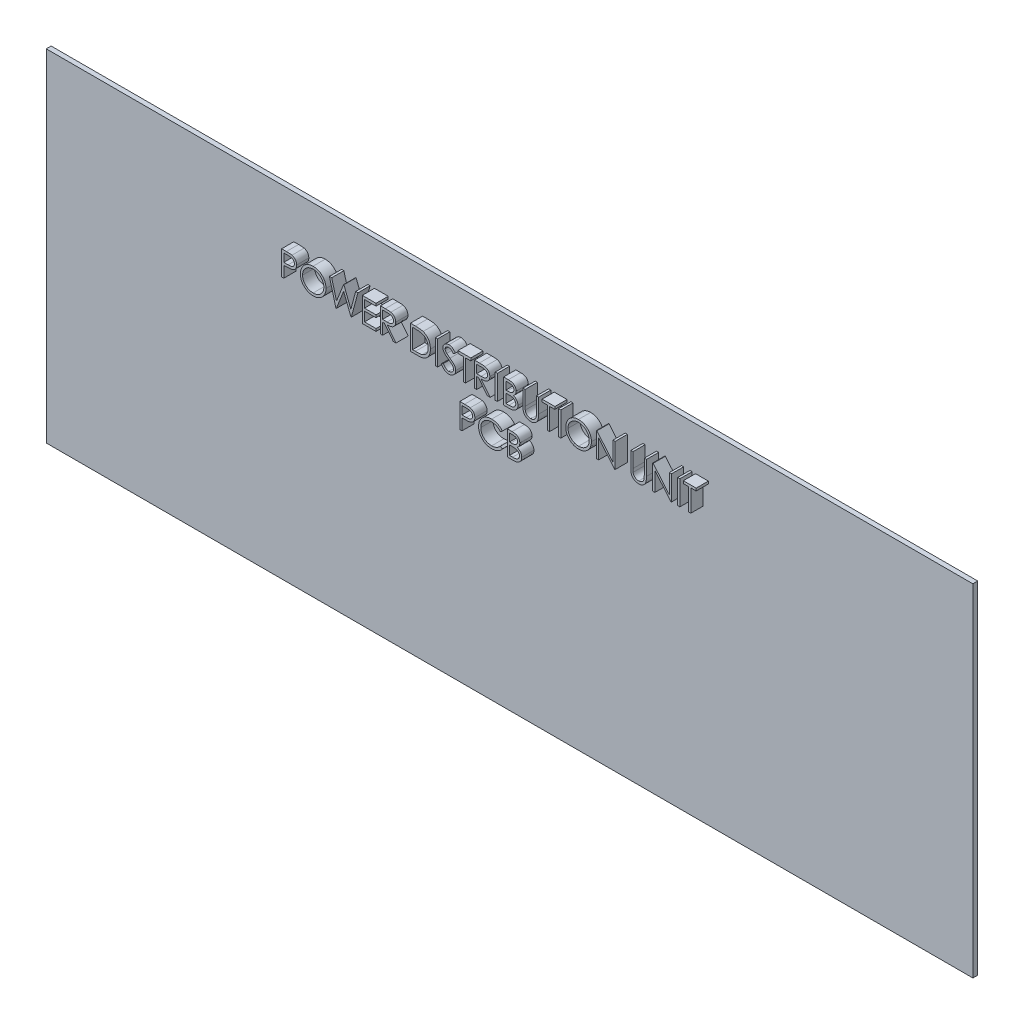
from build123d import *

# Parameters (mm, degrees)
SKETCH1_W           = 380
SKETCH1_H           = 140
BOSS_EXTRUDE1_DEPTH = 2
SKETCH2_W           = 0.897435897
SKETCH2_H           = 10
BOSS_EXTRUDE2_DEPTH = 5


with BuildPart() as part:
    # Sketch1 → Boss-Extrude1 (new body)
    with BuildSketch(Plane.XY):
        Rectangle(SKETCH1_W, SKETCH1_H)
    extrude(amount=BOSS_EXTRUDE1_DEPTH)

    # Sketch2 → Boss-Extrude2 (add)
    # profile 1 of 24: a face of its own
    with BuildSketch(Plane.XY.offset(2)):
        with BuildLine():
            Line((-88.478874156, 52.243094799), (-86.517736336, 52.243094799))
            add(Edge.make_bspline(
                [(-86.517736336, 52.243094799), (-86.382848032, 52.242946524), (-86.124396053, 52.242662423), (-85.753781608, 52.234048863), (-85.417182375, 52.222544028), (-85.115324144, 52.206595762), (-84.847278149, 52.187748362), (-84.614257293, 52.161313963), (-84.414429989, 52.133713119), (-84.294697277, 52.105651957), (-84.240092105, 52.092854414)],
                knots=[0, 0, 0, 0, 1.415646017, 2.712440637, 3.8905458, 4.950247383, 5.884950622, 6.709939814, 7.411656543, 8, 8, 8, 8], degree=3))
            add(Edge.make_bspline(
                [(-84.240092105, 52.092854414), (-84.170967723, 52.073934558), (-84.034347788, 52.036540667), (-83.837487665, 51.961644314), (-83.650190963, 51.872838128), (-83.471815082, 51.771626871), (-83.304551987, 51.653668117), (-83.145906156, 51.523743494), (-82.997277641, 51.378853299), (-82.859502236, 51.220622613), (-82.732974243, 51.051707728), (-82.624032292, 50.869587071), (-82.532811643, 50.677326204), (-82.454573725, 50.475058858), (-82.398263855, 50.261086505), (-82.355844141, 50.036895898), (-82.328919491, 49.802511069), (-82.326340743, 49.642340019), (-82.325028002, 49.560803132)],
                knots=[0, 0, 0, 0, 0.999701418, 1.975846123, 2.934577507, 3.890451536, 4.834027766, 5.787354733, 6.749476667, 7.726910423, 8.712836071, 9.690891519, 10.682875813, 11.679750201, 12.712814741, 13.765529915, 14.8625177, 16, 16, 16, 16], degree=3))
            add(Edge.make_bspline(
                [(-82.325028002, 49.560803132), (-82.326232073, 49.478580913), (-82.328587919, 49.317707587), (-82.356863019, 49.082356764), (-82.394949281, 48.857447078), (-82.453512288, 48.643477219), (-82.530214211, 48.441717875), (-82.620191505, 48.249085784), (-82.728715877, 48.06885815), (-82.853415391, 47.900380671), (-82.992134232, 47.743495207), (-83.144285484, 47.599338652), (-83.309254891, 47.468754827), (-83.486518171, 47.351450988), (-83.677803454, 47.250147333), (-83.880209607, 47.159412176), (-84.095495939, 47.083209145), (-84.244474551, 47.043123256), (-84.32022031, 47.022742235)],
                knots=[0, 0, 0, 0, 1.121902311, 2.195077645, 3.232258892, 4.234102512, 5.217864754, 6.176164875, 7.132989551, 8.084763148, 9.034132444, 9.988522005, 10.94243251, 11.903244335, 12.886203696, 13.894208494, 14.929344452, 16, 16, 16, 16], degree=3))
            add(Edge.make_bspline(
                [(-84.32022031, 47.022742235), (-84.382869836, 47.009419432), (-84.520169914, 46.980221734), (-84.746291977, 46.947626143), (-85.009564508, 46.919804427), (-85.309628165, 46.898944034), (-85.646213608, 46.881085838), (-86.019502915, 46.866891284), (-86.430228849, 46.859091702), (-86.716718118, 46.858689437), (-86.866294028, 46.858479414)],
                knots=[0, 0, 0, 0, 0.601384939, 1.31797006, 2.144135048, 3.087295005, 4.142315834, 5.309527816, 6.595305764, 8, 8, 8, 8], degree=3))
            Line((-86.866294028, 46.858479414), (-87.581438259, 46.858479414))
            Line((-87.581438259, 46.858479414), (-87.581438259, 42.243094799))
            Line((-87.581438259, 42.243094799), (-88.478874156, 42.243094799))
            Line((-88.478874156, 42.243094799), (-88.478874156, 52.243094799))
        make_face()
        with BuildLine():
            Line((-87.581438259, 51.217453773), (-87.581438259, 47.88412044))
            Line((-87.581438259, 47.88412044), (-85.830636977, 47.862085184))
            add(Edge.make_bspline(
                [(-85.830636977, 47.862085184), (-85.745151474, 47.862041002), (-85.580123475, 47.86195571), (-85.341734265, 47.873342063), (-85.120564873, 47.886486442), (-84.917294658, 47.905731937), (-84.731831988, 47.93293553), (-84.563867619, 47.960397639), (-84.414703954, 48.000127246), (-84.240134806, 48.053621729), (-84.045610956, 48.144857774), (-83.833989389, 48.277286031), (-83.654644857, 48.446088055), (-83.499449723, 48.635881859), (-83.376290072, 48.847022228), (-83.286130094, 49.072933476), (-83.233155358, 49.31129876), (-83.226051948, 49.474407729), (-83.2224639, 49.556796722)],
                knots=[0, 0, 0, 0, 1.160613943, 2.240541288, 3.23993089, 4.169200891, 5.011653406, 5.7853311, 6.478053781, 7.106038997, 8.262395093, 9.384106736, 10.481365981, 11.59014053, 12.70357646, 13.786202915, 14.881775077, 16, 16, 16, 16], degree=3))
            add(Edge.make_bspline(
                [(-83.2224639, 49.556796722), (-83.226071461, 49.637192475), (-83.233242847, 49.797009281), (-83.286545313, 50.031234311), (-83.376114781, 50.254764895), (-83.50027648, 50.463259425), (-83.650965422, 50.652370293), (-83.826106403, 50.816647799), (-84.025287149, 50.948709807), (-84.21056781, 51.033947754), (-84.375142627, 51.085991399), (-84.518091084, 51.122405228), (-84.679493011, 51.151478389), (-84.859400952, 51.175019826), (-85.056420478, 51.195172572), (-85.272244234, 51.208846793), (-85.506054644, 51.216850953), (-85.66837056, 51.217247968), (-85.752511977, 51.217453773)],
                knots=[0, 0, 0, 0, 1.120700087, 2.227813068, 3.331159281, 4.466773991, 5.599788987, 6.693661531, 7.80175334, 8.91857717, 9.525282508, 10.207424825, 10.974604443, 11.810962634, 12.737642355, 13.736264703, 14.826523623, 16, 16, 16, 16], degree=3))
            Line((-85.752511977, 51.217453773), (-87.581438259, 51.217453773))
        make_face(mode=Mode.SUBTRACT)
    # profile 2 of 24: a face of its own
    with BuildSketch(Plane.XY.offset(2)):
        with BuildLine():
            add(Edge.make_bspline(
                [(-75.594258772, 52.499505055), (-75.409092755, 52.494815114), (-75.045411421, 52.485603683), (-74.510911713, 52.415091959), (-74.000640012, 52.29310513), (-73.510439615, 52.130639466), (-73.046173968, 51.913912651), (-72.604348561, 51.651955084), (-72.186014636, 51.342022345), (-71.796810688, 50.986510268), (-71.440647973, 50.5997004), (-71.126859727, 50.186906371), (-70.863881745, 49.750624078), (-70.647922353, 49.292164562), (-70.478497754, 48.812564654), (-70.3615862, 48.309267503), (-70.286905771, 47.785534103), (-70.278174979, 47.428314489), (-70.273745951, 47.247101209)],
                knots=[0, 0, 0, 0, 1.065120563, 2.091984664, 3.0946048, 4.079830382, 5.057816894, 6.036188127, 7.030412546, 8.04752943, 9.064399622, 10.05169764, 11.02544977, 11.989514704, 12.962713494, 13.945757189, 14.957906945, 16, 16, 16, 16], degree=3))
            add(Edge.make_bspline(
                [(-70.273745951, 47.247101209), (-70.27817433, 47.067222791), (-70.286903177, 46.71266159), (-70.361671113, 46.192251749), (-70.478931113, 45.691992617), (-70.646349016, 45.212719323), (-70.861278955, 44.753926284), (-71.126008015, 44.316820701), (-71.437840046, 43.901259277), (-71.792716763, 43.511794519), (-72.179576883, 43.154658889), (-72.594520502, 42.843462101), (-73.028215702, 42.575678888), (-73.48624344, 42.362011248), (-73.962529259, 42.191234332), (-74.461335897, 42.074798247), (-74.980326051, 41.999692409), (-75.334243205, 41.991068077), (-75.514130566, 41.986684543)],
                knots=[0, 0, 0, 0, 1.043624062, 2.057103931, 3.04512605, 4.022047818, 4.998200453, 5.980619268, 6.982898556, 8.009068085, 9.034988726, 10.034168286, 11.015286542, 11.987931943, 12.962482838, 13.94673481, 14.956375938, 16, 16, 16, 16], degree=3))
            add(Edge.make_bspline(
                [(-75.514130566, 41.986684543), (-75.695342906, 41.991111362), (-76.052560666, 41.999837802), (-76.576952196, 42.074641816), (-77.080602893, 42.191616969), (-77.562072467, 42.358786787), (-78.021629409, 42.574836018), (-78.460172503, 42.838277101), (-78.875941495, 43.150868933), (-79.265489342, 43.505630574), (-79.621915622, 43.891835009), (-79.932656696, 44.305647166), (-80.196157019, 44.738948471), (-80.411480827, 45.192941397), (-80.58195071, 45.665431233), (-80.698250191, 46.15956974), (-80.773495768, 46.672539757), (-80.782166758, 47.021805181), (-80.786566464, 47.199024286)],
                knots=[0, 0, 0, 0, 1.053102029, 2.075944431, 3.073151272, 4.055350789, 5.033113405, 6.020478099, 7.024410459, 8.052272461, 9.079885166, 10.07527673, 11.055994387, 12.023226415, 12.992069828, 13.970394897, 14.97016774, 16, 16, 16, 16], degree=3))
            add(Edge.make_bspline(
                [(-80.786566464, 47.199024286), (-80.785038934, 47.317974769), (-80.782003144, 47.554375122), (-80.745455452, 47.905422551), (-80.692422019, 48.250824431), (-80.616416555, 48.589598568), (-80.517011792, 48.920915667), (-80.399720285, 49.247060703), (-80.256463584, 49.564728486), (-80.094518876, 49.87542389), (-79.913770853, 50.174303621), (-79.714125854, 50.456816716), (-79.50259623, 50.72533385), (-79.27070082, 50.972896718), (-79.026082405, 51.206707165), (-78.764772753, 51.423172071), (-78.488366341, 51.624243359), (-78.195673827, 51.805444333), (-77.893907327, 51.969327575), (-77.582830819, 52.109961435), (-77.266669187, 52.230664468), (-76.943941621, 52.328495397), (-76.615505129, 52.405729786), (-76.280642888, 52.458322225), (-75.93962167, 52.494963133), (-75.709875044, 52.497984567), (-75.594258772, 52.499505055)],
                knots=[0, 0, 0, 0, 1.037015668, 2.060948919, 3.074880161, 4.083647147, 5.086022904, 6.090072063, 7.104153813, 8.122640571, 9.144368836, 10.147691507, 11.138137339, 12.123020368, 13.103399296, 14.087645067, 15.080126199, 16.082011238, 17.087798457, 18.072939717, 19.057185487, 20.037253025, 21.01195951, 21.997135196, 22.992090687, 24, 24, 24, 24], degree=3))
        make_face()
        with BuildLine():
            add(Edge.make_bspline(
                [(-75.550188259, 51.47386403), (-75.645087212, 51.4727072), (-75.833977877, 51.470404601), (-76.114790838, 51.440073985), (-76.391910649, 51.396845731), (-76.665394541, 51.335184243), (-76.934098225, 51.251172664), (-77.200526342, 51.154484355), (-77.462249353, 51.03670981), (-77.718403233, 50.903644941), (-77.966732019, 50.75636231), (-78.201054023, 50.593585832), (-78.421975863, 50.41913282), (-78.628956625, 50.232596142), (-78.821388546, 50.033025851), (-79.003059121, 49.823447462), (-79.166686497, 49.597870631), (-79.316645288, 49.362412325), (-79.450839118, 49.117379236), (-79.570168702, 48.865351058), (-79.667780156, 48.604271953), (-79.747386946, 48.33697436), (-79.813386405, 48.063881618), (-79.855197617, 47.78292205), (-79.885861501, 47.495507444), (-79.888032488, 47.301273576), (-79.889130566, 47.203030696)],
                knots=[0, 0, 0, 0, 1.008559885, 2.007477868, 2.99961109, 3.989939068, 4.984837346, 5.991145699, 7.001802488, 8.033829008, 9.059044045, 10.069351652, 11.065060232, 12.050310815, 13.029377138, 14.011219647, 14.996725999, 15.989392538, 16.977580475, 17.965360261, 18.951710183, 19.937753436, 20.929683414, 21.935841486, 22.955955122, 24, 24, 24, 24], degree=3))
            add(Edge.make_bspline(
                [(-79.889130566, 47.203030696), (-79.885488104, 47.058567208), (-79.878322253, 46.774362836), (-79.815586338, 46.357882425), (-79.718952125, 45.957630178), (-79.576502507, 45.575796152), (-79.398357894, 45.209098201), (-79.178281064, 44.86078933), (-78.91754082, 44.530775404), (-78.621359315, 44.221360349), (-78.297580153, 43.938943766), (-77.953772354, 43.691048313), (-77.593619189, 43.481304742), (-77.216181467, 43.310433106), (-76.823474213, 43.175033855), (-76.412966924, 43.082237767), (-75.987394183, 43.021165037), (-75.697306597, 43.01530002), (-75.550188259, 43.012325568)],
                knots=[0, 0, 0, 0, 1.032063989, 2.030389145, 3.003944642, 3.970395727, 4.937377036, 5.913328081, 6.909231446, 7.93887556, 8.970685674, 9.976071282, 10.964166581, 11.944589148, 12.933237628, 13.927779006, 14.949070134, 16, 16, 16, 16], degree=3))
            add(Edge.make_bspline(
                [(-75.550188259, 43.012325568), (-75.451303968, 43.013684152), (-75.255186722, 43.016378632), (-74.963485229, 43.043517709), (-74.67703891, 43.087037336), (-74.396249539, 43.149696352), (-74.121435792, 43.228116941), (-73.85145064, 43.321281878), (-73.589169811, 43.437513889), (-73.33128456, 43.565936608), (-73.084438155, 43.712337058), (-72.848793777, 43.869588914), (-72.630290978, 44.043784973), (-72.423465059, 44.227550152), (-72.230243091, 44.424589717), (-72.051931707, 44.634647494), (-71.88913133, 44.859049372), (-71.739229482, 45.094150531), (-71.605505874, 45.33985411), (-71.488994163, 45.592796047), (-71.390148117, 45.852353502), (-71.310352389, 46.118900849), (-71.247822499, 46.391931846), (-71.204737013, 46.671812069), (-71.174598617, 46.957981619), (-71.172326968, 47.151535493), (-71.171181848, 47.249104414)],
                knots=[0, 0, 0, 0, 1.047197238, 2.076906641, 3.100256066, 4.114471768, 5.12198147, 6.126382909, 7.136867548, 8.15857795, 9.17633901, 10.174870724, 11.156907918, 12.133735059, 13.104061851, 14.077631395, 15.04955518, 16.038496417, 17.029181396, 18.010275684, 18.986308667, 19.968651475, 20.955262928, 21.950658345, 22.966943676, 24, 24, 24, 24], degree=3))
            add(Edge.make_bspline(
                [(-71.171181848, 47.249104414), (-71.172327886, 47.346005855), (-71.174601261, 47.538227713), (-71.204722617, 47.822401479), (-71.247868018, 48.100267798), (-71.310047184, 48.370735807), (-71.390190481, 48.63387445), (-71.489011425, 48.889436586), (-71.605540852, 49.138374286), (-71.739278636, 49.380072278), (-71.88960956, 49.6120001), (-72.053878826, 49.833721279), (-72.234922678, 50.041071968), (-72.427568464, 50.239171094), (-72.636628136, 50.423793636), (-72.86115469, 50.595000838), (-73.098422341, 50.756924479), (-73.349643014, 50.902997513), (-73.608911453, 51.03789532), (-73.874951333, 51.153469615), (-74.14474876, 51.25167567), (-74.417617653, 51.335438428), (-74.695854734, 51.396604228), (-74.977579959, 51.440112942), (-75.262403555, 51.470394045), (-75.453955611, 51.472703698), (-75.550188259, 51.47386403)],
                knots=[0, 0, 0, 0, 1.02996197, 2.043119294, 3.035359645, 4.018872909, 4.991431989, 5.957985074, 6.929999688, 7.912076566, 8.892894881, 9.867085534, 10.843653904, 11.817741046, 12.803660682, 13.806313499, 14.818574707, 15.856120519, 16.894564902, 17.924820532, 18.937903209, 19.946497019, 20.957711757, 21.963978472, 22.977135795, 24, 24, 24, 24], degree=3))
        make_face(mode=Mode.SUBTRACT)
    # profile 3 of 24: a face of its own
    with BuildSketch(Plane.XY.offset(2)):
        Polygon((-68.863489541, 52.243094799), (-67.936005566, 52.243094799), (-65.978874156, 44.909360825), (-63.068217105, 52.243094799), (-62.938008772, 52.243094799), (-60.081438259, 44.959440953), (-58.114290823, 52.243094799), (-57.196822874, 52.243094799), (-59.893136977, 42.243094799), (-60.021342105, 42.243094799), (-63.030156207, 49.891331978), (-66.075028002, 42.243094799), (-66.203233131, 42.243094799), align=None)
    # profile 4 of 24: a face of its own
    with BuildSketch(Plane.XY.offset(2)):
        Polygon((-55.401951079, 52.243094799), (-49.760925438, 52.243094799), (-49.760925438, 51.217453773), (-54.504515182, 51.217453773), (-54.504515182, 48.140530696), (-49.760925438, 48.140530696), (-49.760925438, 47.114889671), (-54.504515182, 47.114889671), (-54.504515182, 43.268735825), (-49.760925438, 43.268735825), (-49.760925438, 42.243094799), (-55.401951079, 42.243094799), align=None)
    # profile 5 of 24: a face of its own
    with BuildSketch(Plane.XY.offset(2)):
        with BuildLine():
            Line((-47.966053643, 52.243094799), (-45.96485172, 52.243094799))
            add(Edge.make_bspline(
                [(-45.96485172, 52.243094799), (-45.831305639, 52.242650268), (-45.574882369, 52.241796718), (-45.207530168, 52.237037395), (-44.873738462, 52.223396379), (-44.573681779, 52.211657569), (-44.307365621, 52.190252023), (-44.073973362, 52.169793031), (-43.874579941, 52.143011143), (-43.753877508, 52.118138506), (-43.69922672, 52.10687685)],
                knots=[0, 0, 0, 0, 1.410062039, 2.707475311, 3.878576406, 4.937260626, 5.877586885, 6.699081471, 7.410979367, 8, 8, 8, 8], degree=3))
            add(Edge.make_bspline(
                [(-43.69922672, 52.10687685), (-43.626064937, 52.088800378), (-43.48130211, 52.053033053), (-43.27287335, 51.977434194), (-43.074260996, 51.889949552), (-42.886290069, 51.787196065), (-42.709902094, 51.66841098), (-42.543278349, 51.535644916), (-42.385662739, 51.389624328), (-42.24342951, 51.226667638), (-42.109317934, 51.055706182), (-41.996207573, 50.870838305), (-41.898703345, 50.677519655), (-41.821073296, 50.473784176), (-41.758564801, 50.261607685), (-41.714489831, 50.039068266), (-41.688057866, 49.807179766), (-41.685366851, 49.649014312), (-41.684002361, 49.568815953)],
                knots=[0, 0, 0, 0, 1.027469482, 2.033020251, 3.019912614, 3.986113645, 4.951240523, 5.91722682, 6.890402269, 7.87763091, 8.8651537, 9.85103654, 10.82876324, 11.815024772, 12.821070561, 13.842952187, 14.906261191, 16, 16, 16, 16], degree=3))
            add(Edge.make_bspline(
                [(-41.684002361, 49.568815953), (-41.688199499, 49.435572797), (-41.696389201, 49.175580889), (-41.77274664, 48.798264084), (-41.897822411, 48.446294614), (-42.070174665, 48.120115649), (-42.289658881, 47.826085233), (-42.553443999, 47.56782679), (-42.861677174, 47.351712754), (-43.148618077, 47.201847597), (-43.402087219, 47.105867858), (-43.610753827, 47.038335404), (-43.838373763, 46.986158361), (-44.082766147, 46.939415127), (-44.34494802, 46.904124572), (-44.62429099, 46.878277159), (-44.92099428, 46.862122734), (-45.124820193, 46.859717006), (-45.229675438, 46.858479414)],
                knots=[0, 0, 0, 0, 1.260483769, 2.459530307, 3.627416485, 4.787058657, 5.939039949, 7.08810263, 8.267026773, 9.491475466, 10.141966685, 10.831826277, 11.566392101, 12.351337768, 13.187381173, 14.07005841, 15.007169909, 16, 16, 16, 16], degree=3))
            Line((-45.229675438, 46.858479414), (-41.555797233, 42.243094799))
            Line((-41.555797233, 42.243094799), (-42.665572874, 42.243094799))
            Line((-42.665572874, 42.243094799), (-46.339451079, 46.858479414))
            Line((-46.339451079, 46.858479414), (-47.068617746, 46.858479414))
            Line((-47.068617746, 46.858479414), (-47.068617746, 42.243094799))
            Line((-47.068617746, 42.243094799), (-47.966053643, 42.243094799))
            Line((-47.966053643, 42.243094799), (-47.966053643, 52.243094799))
        make_face()
        with BuildLine():
            Line((-47.068617746, 51.217453773), (-47.068617746, 47.88412044))
            Line((-47.068617746, 47.88412044), (-45.237688259, 47.870098004))
            add(Edge.make_bspline(
                [(-45.237688259, 47.870098004), (-45.152202433, 47.870060185), (-44.986506556, 47.869986881), (-44.746790371, 47.88139767), (-44.523590051, 47.89437858), (-44.317759331, 47.914233853), (-44.129206259, 47.939822629), (-43.958025078, 47.971831155), (-43.803936358, 48.009122763), (-43.624226249, 48.066841694), (-43.423550445, 48.15828746), (-43.205460559, 48.291331742), (-43.019739594, 48.458672083), (-42.862831416, 48.650024814), (-42.736747326, 48.860414097), (-42.647855743, 49.087318009), (-42.591448765, 49.325008289), (-42.584795778, 49.488374311), (-42.581438259, 49.570819158)],
                knots=[0, 0, 0, 0, 1.146690395, 2.22261258, 3.21895312, 4.145990853, 4.996080663, 5.770904154, 6.481378293, 7.121626537, 8.300444488, 9.431385265, 10.535395872, 11.636531494, 12.74115979, 13.810798291, 14.895190096, 16, 16, 16, 16], degree=3))
            add(Edge.make_bspline(
                [(-42.581438259, 49.570819158), (-42.58487289, 49.65123794), (-42.591679077, 49.810598622), (-42.647246987, 50.043901223), (-42.741216648, 50.264092509), (-42.867851614, 50.470276752), (-43.022134914, 50.657435997), (-43.20304295, 50.81757072), (-43.405629222, 50.949712048), (-43.594975503, 51.034153135), (-43.76421611, 51.085924144), (-43.911157996, 51.122356041), (-44.077190789, 51.151625952), (-44.263120671, 51.175077554), (-44.468153902, 51.195234538), (-44.693327191, 51.208811048), (-44.937146563, 51.21685066), (-45.106137795, 51.217248057), (-45.193617746, 51.217453773)],
                knots=[0, 0, 0, 0, 1.101028733, 2.181837193, 3.264309656, 4.369019818, 5.486613113, 6.575447106, 7.666700264, 8.788928104, 9.402425223, 10.0903467, 10.862060571, 11.710948788, 12.657782767, 13.684531032, 14.801375019, 16, 16, 16, 16], degree=3))
            Line((-45.193617746, 51.217453773), (-47.068617746, 51.217453773))
        make_face(mode=Mode.SUBTRACT)
    # profile 6 of 24: a face of its own
    with BuildSketch(Plane.XY.offset(2)):
        with BuildLine():
            Line((-35.658361336, 42.243094799), (-35.658361336, 52.243094799))
            Line((-35.658361336, 52.243094799), (-33.639130566, 52.243094799))
            add(Edge.make_bspline(
                [(-33.639130566, 52.243094799), (-33.463504886, 52.241830313), (-33.124196985, 52.239387333), (-32.633875706, 52.223897644), (-32.180207814, 52.196496313), (-31.764685359, 52.156583382), (-31.386167611, 52.107574714), (-31.045714445, 52.046144987), (-30.741565465, 51.973607358), (-30.55450992, 51.911763214), (-30.466053643, 51.882517876)],
                knots=[0, 0, 0, 0, 1.314313732, 2.53924729, 3.670748893, 4.714932338, 5.66265055, 6.526160246, 7.303039223, 8, 8, 8, 8], degree=3))
            add(Edge.make_bspline(
                [(-30.466053643, 51.882517876), (-30.350354388, 51.838430145), (-30.121579553, 51.751254448), (-29.795844917, 51.586807873), (-29.489201023, 51.400484725), (-29.200003466, 51.192039403), (-28.934858248, 50.955569836), (-28.683407114, 50.70112102), (-28.455936475, 50.419440048), (-28.247627058, 50.116368654), (-28.059810888, 49.795477076), (-27.896556151, 49.457376765), (-27.760973313, 49.103784742), (-27.648421237, 48.735684319), (-27.559717073, 48.352266097), (-27.499197268, 47.953083623), (-27.459280154, 47.53971451), (-27.455268579, 47.259216042), (-27.453233131, 47.116892876)],
                knots=[0, 0, 0, 0, 0.984719456, 1.947108742, 2.898477687, 3.838006223, 4.779231079, 5.722358779, 6.681677486, 7.655904652, 8.64651281, 9.637519902, 10.640069247, 11.656948941, 12.698408672, 13.768548281, 14.867775369, 16, 16, 16, 16], degree=3))
            add(Edge.make_bspline(
                [(-27.453233131, 47.116892876), (-27.45503018, 46.993289337), (-27.458571455, 46.749715655), (-27.4903695, 46.390741667), (-27.536587558, 46.042417178), (-27.608142409, 45.706400892), (-27.695006733, 45.379748841), (-27.806332879, 45.065942428), (-27.933862868, 44.762102973), (-28.082576807, 44.472338756), (-28.245837907, 44.197814835), (-28.421042888, 43.939027612), (-28.608004875, 43.699669835), (-28.808506683, 43.479016658), (-29.019957301, 43.27740072), (-29.243741103, 43.093137819), (-29.480435534, 42.929833376), (-29.728980456, 42.78107021), (-29.996626539, 42.651297766), (-30.2884433, 42.541497738), (-30.605675237, 42.450507408), (-30.947543685, 42.374590563), (-31.314639336, 42.314369698), (-31.707322095, 42.274008577), (-32.124988637, 42.246714484), (-32.411786538, 42.244324788), (-32.559403002, 42.243094799)],
                knots=[0, 0, 0, 0, 1.105936401, 2.179363191, 3.223086493, 4.248585256, 5.251745608, 6.245858792, 7.225916811, 8.198733463, 9.158002045, 10.082870192, 10.993790845, 11.873723703, 12.748670949, 13.606408763, 14.465103618, 15.319838547, 16.196477973, 17.123216899, 18.106603292, 19.147568657, 20.255746949, 21.433717677, 22.679120308, 24, 24, 24, 24], degree=3))
            Line((-32.559403002, 42.243094799), (-35.658361336, 42.243094799))
        make_face()
        with BuildLine():
            Line((-34.760925438, 43.268735825), (-33.6130889, 43.268735825))
            add(Edge.make_bspline(
                [(-33.6130889, 43.268735825), (-33.448150698, 43.269444671), (-33.130914131, 43.270808043), (-32.674748424, 43.282771481), (-32.257950149, 43.302319874), (-31.880460122, 43.329677239), (-31.542491481, 43.365873282), (-31.24333791, 43.406230147), (-30.983980029, 43.456508578), (-30.82703878, 43.502082748), (-30.754515182, 43.523142876)],
                knots=[0, 0, 0, 0, 1.375205317, 2.645023457, 3.804390687, 4.853969522, 5.800190428, 6.637939096, 7.370582563, 8, 8, 8, 8], degree=3))
            add(Edge.make_bspline(
                [(-30.754515182, 43.523142876), (-30.663234147, 43.555290185), (-30.482852324, 43.618816966), (-30.22319208, 43.734695998), (-29.98102921, 43.871959054), (-29.752143423, 44.02453698), (-29.539781551, 44.197811271), (-29.341426933, 44.388014097), (-29.157478929, 44.596113454), (-28.989838049, 44.821851058), (-28.839814323, 45.063821903), (-28.709896525, 45.319647142), (-28.596035006, 45.586523743), (-28.506667599, 45.86854991), (-28.436623072, 46.163204363), (-28.387009678, 46.470507829), (-28.356110465, 46.79040292), (-28.352506328, 47.007980418), (-28.350669028, 47.118896081)],
                knots=[0, 0, 0, 0, 0.998632004, 1.973411704, 2.929992603, 3.868527914, 4.809262121, 5.754881198, 6.702106254, 7.672490631, 8.653608572, 9.636854334, 10.631411391, 11.644891563, 12.686317036, 13.754757253, 14.855430412, 16, 16, 16, 16], degree=3))
            add(Edge.make_bspline(
                [(-28.350669028, 47.118896081), (-28.352135563, 47.235848882), (-28.355016585, 47.465603694), (-28.3912289, 47.802719967), (-28.44414763, 48.126950397), (-28.520672448, 48.438316669), (-28.618189244, 48.737426247), (-28.739888221, 49.022624847), (-28.878935704, 49.296924473), (-29.04437381, 49.553994089), (-29.225561219, 49.797117258), (-29.426640875, 50.019845588), (-29.644418127, 50.222686446), (-29.876517697, 50.408798768), (-30.129480838, 50.570694985), (-30.397348526, 50.715514074), (-30.684050444, 50.83841662), (-30.883515289, 50.9037848), (-30.984883772, 50.937005055)],
                knots=[0, 0, 0, 0, 1.122418816, 2.205001699, 3.251619955, 4.274784885, 5.280384055, 6.268708349, 7.249350384, 8.229342522, 9.199999885, 10.157847722, 11.105861043, 12.055065948, 13.010012805, 13.98527497, 14.976112212, 16, 16, 16, 16], degree=3))
            add(Edge.make_bspline(
                [(-30.984883772, 50.937005055), (-31.06874419, 50.960194849), (-31.247054448, 51.009502714), (-31.538024345, 51.063289492), (-31.8654962, 51.110730918), (-32.230923918, 51.150896745), (-32.633890944, 51.179717663), (-33.074707195, 51.20134999), (-33.553563208, 51.215940369), (-33.885513305, 51.216936675), (-34.057800438, 51.217453773)],
                knots=[0, 0, 0, 0, 0.674548936, 1.434276114, 2.292660221, 3.240891867, 4.284742987, 5.42552168, 6.663806718, 8, 8, 8, 8], degree=3))
            Line((-34.057800438, 51.217453773), (-34.760925438, 51.217453773))
            Line((-34.760925438, 51.217453773), (-34.760925438, 43.268735825))
        make_face(mode=Mode.SUBTRACT)
    # profile 7 of 24: a face of its own
    with BuildSketch(Plane.XY.offset(2)):
        with Locations((-24.953233131, 47.243094799)):
            Rectangle(SKETCH2_W, SKETCH2_H)
    # profile 8 of 24: a face of its own
    with BuildSketch(Plane.XY.offset(2)):
        with BuildLine():
            Line((-22.966053643, 44.172181337), (-22.120701079, 44.678992235))
            add(Edge.make_bspline(
                [(-22.120701079, 44.678992235), (-22.042077544, 44.547379706), (-21.891437885, 44.295215181), (-21.640148288, 43.954477923), (-21.379768542, 43.66487176), (-21.108370446, 43.428081453), (-20.827610594, 43.241656062), (-20.535656155, 43.109649686), (-20.233490981, 43.027318328), (-20.027851491, 43.017318081), (-19.925188259, 43.012325568)],
                knots=[0, 0, 0, 0, 1.272034388, 2.437168799, 3.508375237, 4.49857839, 5.41946034, 6.295179144, 7.148887113, 8, 8, 8, 8], degree=3))
            add(Edge.make_bspline(
                [(-19.925188259, 43.012325568), (-19.837511514, 43.01476749), (-19.663692163, 43.019608605), (-19.40780004, 43.066125182), (-19.159280605, 43.137588407), (-18.923255926, 43.239933926), (-18.702982741, 43.363758171), (-18.509820755, 43.513318678), (-18.34283186, 43.68076498), (-18.20623439, 43.867572565), (-18.101434289, 44.068478704), (-18.020885522, 44.274695708), (-17.976185312, 44.489463045), (-17.96945173, 44.634064368), (-17.966053643, 44.707037107)],
                knots=[0, 0, 0, 0, 1.095163259, 2.171163733, 3.241058638, 4.321873601, 5.38011039, 6.391990106, 7.366004449, 8.327778327, 9.272591725, 10.192022065, 11.087607919, 12, 12, 12, 12], degree=3))
            add(Edge.make_bspline(
                [(-17.966053643, 44.707037107), (-17.97026596, 44.790296677), (-17.978828983, 44.959551218), (-18.05120464, 45.209264512), (-18.165059631, 45.45638614), (-18.270095756, 45.609246899), (-18.324627361, 45.688607619)],
                knots=[0, 0, 0, 0, 0.938893495, 1.908633276, 2.914225137, 4, 4, 4, 4], degree=3))
            add(Edge.make_bspline(
                [(-18.324627361, 45.688607619), (-18.369400545, 45.745884258), (-18.463396243, 45.866129397), (-18.624989136, 46.045115784), (-18.814606605, 46.229739838), (-19.025759619, 46.42705143), (-19.266139873, 46.627873706), (-19.528218486, 46.841783071), (-19.818686654, 47.06064472), (-20.022399502, 47.207423479), (-20.127511977, 47.283158902)],
                knots=[0, 0, 0, 0, 0.722233717, 1.516239348, 2.393582979, 3.351407094, 4.387010283, 5.505090956, 6.712668013, 8, 8, 8, 8], degree=3))
            add(Edge.make_bspline(
                [(-20.127511977, 47.283158902), (-20.232723394, 47.358097723), (-20.433879613, 47.501375044), (-20.715189848, 47.714015855), (-20.966745457, 47.908426911), (-21.187428361, 48.086438374), (-21.377141495, 48.248074388), (-21.537379812, 48.391782785), (-21.664061404, 48.521450102), (-21.73450592, 48.605568222), (-21.766133772, 48.643335184)],
                knots=[0, 0, 0, 0, 1.452282411, 2.77665338, 3.964542531, 5.026858415, 5.96415736, 6.766646006, 7.446254459, 8, 8, 8, 8], degree=3))
            add(Edge.make_bspline(
                [(-21.766133772, 48.643335184), (-21.810341044, 48.702195289), (-21.897280577, 48.817951585), (-22.012040593, 48.99887975), (-22.109581058, 49.18408908), (-22.186044864, 49.374077265), (-22.250434061, 49.566177061), (-22.293742434, 49.762894906), (-22.320860711, 49.963348102), (-22.323637815, 50.098243818), (-22.325028002, 50.165771081)],
                knots=[0, 0, 0, 0, 1.068054152, 2.10047183, 3.106115577, 4.101338837, 5.06977816, 6.043150881, 7.020423561, 8, 8, 8, 8], degree=3))
            add(Edge.make_bspline(
                [(-22.325028002, 50.165771081), (-22.321298834, 50.271570437), (-22.313920205, 50.480907762), (-22.251518727, 50.786710135), (-22.153024745, 51.078671327), (-22.015039351, 51.353900852), (-21.8371612, 51.605232225), (-21.631315559, 51.835556474), (-21.386139884, 52.029180995), (-21.117132389, 52.198358304), (-20.822685612, 52.330775233), (-20.514140173, 52.430663748), (-20.191005682, 52.487261627), (-19.972139583, 52.495383813), (-19.861085695, 52.499505055)],
                knots=[0, 0, 0, 0, 1.005424448, 1.989358655, 2.955360095, 3.929531133, 4.905563448, 5.876582895, 6.856512386, 7.866279853, 8.892233794, 9.918561126, 10.94386622, 12, 12, 12, 12], degree=3))
            add(Edge.make_bspline(
                [(-19.861085695, 52.499505055), (-19.743245408, 52.495440622), (-19.508898689, 52.487357762), (-19.164186644, 52.417079101), (-18.832298883, 52.300791467), (-18.565318127, 52.168823873), (-18.356367379, 52.037019828), (-18.197016715, 51.916963187), (-18.035538284, 51.778748591), (-17.870629556, 51.622007888), (-17.705084815, 51.445302885), (-17.53644638, 51.249843774), (-17.364319897, 51.036825043), (-17.253588868, 50.884755041), (-17.196822874, 50.806796722)],
                knots=[0, 0, 0, 0, 1.286793592, 2.559021753, 3.825965368, 5.121522368, 5.803751409, 6.523245864, 7.299691795, 8.125521123, 9.008227632, 9.944561021, 10.946284179, 12, 12, 12, 12], degree=3))
            Line((-17.196822874, 50.806796722), (-18.008120951, 50.191812748))
            add(Edge.make_bspline(
                [(-18.008120951, 50.191812748), (-18.05710933, 50.254923292), (-18.151449493, 50.376459444), (-18.294676598, 50.546663203), (-18.429672735, 50.702138858), (-18.562673877, 50.837182081), (-18.686655681, 50.959188177), (-18.806990088, 51.063644625), (-18.921945377, 51.151574897), (-19.066850836, 51.24541364), (-19.24890146, 51.338432222), (-19.477428706, 51.417143873), (-19.716246635, 51.46444405), (-19.878902725, 51.470698015), (-19.961245951, 51.47386403)],
                knots=[0, 0, 0, 0, 1.181633172, 2.275549214, 3.290209073, 4.226197932, 5.078386478, 5.862611352, 6.581680152, 7.217281963, 8.414376989, 9.595101626, 10.782541182, 12, 12, 12, 12], degree=3))
            add(Edge.make_bspline(
                [(-19.961245951, 51.47386403), (-20.064550301, 51.47040203), (-20.263763008, 51.463725889), (-20.546592254, 51.390811646), (-20.801146325, 51.27600633), (-21.01986794, 51.115106393), (-21.201973588, 50.924474985), (-21.333703471, 50.705106828), (-21.412989655, 50.462871392), (-21.42266474, 50.293895231), (-21.427592105, 50.207838389)],
                knots=[0, 0, 0, 0, 1.14458467, 2.207223713, 3.21896685, 4.227309161, 5.202851033, 6.127160689, 7.046193047, 8, 8, 8, 8], degree=3))
            add(Edge.make_bspline(
                [(-21.427592105, 50.207838389), (-21.426468886, 50.154262736), (-21.424220611, 50.047023823), (-21.392864047, 49.888591189), (-21.352580249, 49.730558791), (-21.288744159, 49.573637125), (-21.20061472, 49.415081814), (-21.084885646, 49.252162564), (-20.939133326, 49.083443396), (-20.827484719, 48.973708042), (-20.768537618, 48.915771081)],
                knots=[0, 0, 0, 0, 0.858281714, 1.717966888, 2.583508476, 3.4729293, 4.427298488, 5.488583878, 6.674047936, 8, 8, 8, 8], degree=3))
            add(Edge.make_bspline(
                [(-20.768537618, 48.915771081), (-20.746647982, 48.896236722), (-20.694643219, 48.849827555), (-20.599569145, 48.77384961), (-20.474018293, 48.680127404), (-20.321269147, 48.564163642), (-20.138505256, 48.429645179), (-19.925706525, 48.278292001), (-19.685245002, 48.10519069), (-19.514610957, 47.984169145), (-19.424386977, 47.920178132)],
                knots=[0, 0, 0, 0, 0.420754252, 0.999615792, 1.744751191, 2.668019286, 3.750313428, 4.999500688, 6.413464383, 8, 8, 8, 8], degree=3))
            add(Edge.make_bspline(
                [(-19.424386977, 47.920178132), (-19.315855796, 47.841202819), (-19.105700206, 47.688278071), (-18.806678549, 47.458518986), (-18.535553383, 47.233811075), (-18.291372802, 47.015589341), (-18.071724492, 46.805509075), (-17.87904529, 46.601042846), (-17.711371917, 46.403655495), (-17.530859865, 46.150590993), (-17.346408952, 45.839787895), (-17.188004645, 45.458992928), (-17.088123652, 45.076717726), (-17.075062179, 44.819783908), (-17.068617746, 44.693014671)],
                knots=[0, 0, 0, 0, 1.163667725, 2.253281268, 3.268753668, 4.215851969, 5.092017293, 5.902905408, 6.650798638, 7.335211899, 8.59617414, 9.77448103, 10.901945474, 12, 12, 12, 12], degree=3))
            add(Edge.make_bspline(
                [(-17.068617746, 44.693014671), (-17.070495283, 44.603362199), (-17.074213898, 44.425798246), (-17.116959366, 44.165069455), (-17.179586981, 43.911838399), (-17.273979078, 43.66923522), (-17.389188101, 43.432821613), (-17.535377381, 43.20879904), (-17.704827909, 42.99220933), (-17.899210094, 42.788827926), (-18.111912672, 42.602124509), (-18.336723228, 42.436041476), (-18.574009722, 42.297560552), (-18.822484913, 42.184558146), (-19.082205875, 42.096176668), (-19.353085257, 42.032139899), (-19.635569575, 41.992837867), (-19.827570951, 41.988758549), (-19.925188259, 41.986684543)],
                knots=[0, 0, 0, 0, 0.983748083, 1.948392443, 2.894712957, 3.844097841, 4.80183111, 5.778335162, 6.776009319, 7.81870978, 8.863265674, 9.881300176, 10.883814829, 11.87499822, 12.874611388, 13.892143829, 14.928324115, 16, 16, 16, 16], degree=3))
            add(Edge.make_bspline(
                [(-19.925188259, 41.986684543), (-20.00071781, 41.988145061), (-20.150825696, 41.991047705), (-20.372852787, 42.016708507), (-20.59039447, 42.053014517), (-20.800720991, 42.110654717), (-21.006542167, 42.180588937), (-21.206962837, 42.266698459), (-21.402080133, 42.369890463), (-21.592987513, 42.487876247), (-21.77919944, 42.625184089), (-21.958969349, 42.785108365), (-22.138195593, 42.963238379), (-22.311588154, 43.164411417), (-22.482654281, 43.385377368), (-22.648021165, 43.628203606), (-22.811111787, 43.891567474), (-22.913441695, 44.07689629), (-22.966053643, 44.172181337)],
                knots=[0, 0, 0, 0, 0.915332311, 1.819136955, 2.706846663, 3.586547465, 4.459518054, 5.340707479, 6.227863349, 7.133153174, 8.059268498, 9.028702269, 10.047606654, 11.120612155, 12.245963614, 13.433783089, 14.680604001, 16, 16, 16, 16], degree=3))
        make_face()
    # profile 9 of 24: a face of its own
    with BuildSketch(Plane.XY.offset(2)):
        Polygon((-16.171181848, 51.217453773), (-16.171181848, 52.243094799), (-10.914771592, 52.243094799), (-10.914771592, 51.217453773), (-13.094258772, 51.217453773), (-13.094258772, 42.243094799), (-13.991694669, 42.243094799), (-13.991694669, 51.217453773), align=None)
    # profile 10 of 24: a face of its own
    with BuildSketch(Plane.XY.offset(2)):
        with BuildLine():
            Line((-9.376310054, 52.243094799), (-7.375108131, 52.243094799))
            add(Edge.make_bspline(
                [(-7.375108131, 52.243094799), (-7.241562049, 52.242650268), (-6.985138779, 52.241796718), (-6.617786578, 52.237037395), (-6.283994873, 52.223396379), (-5.983938189, 52.211657569), (-5.717622032, 52.190252023), (-5.484229772, 52.169793031), (-5.284836351, 52.143011143), (-5.164133919, 52.118138506), (-5.109483131, 52.10687685)],
                knots=[0, 0, 0, 0, 1.410062039, 2.707475311, 3.878576406, 4.937260626, 5.877586885, 6.699081471, 7.410979367, 8, 8, 8, 8], degree=3))
            add(Edge.make_bspline(
                [(-5.109483131, 52.10687685), (-5.036321347, 52.088800378), (-4.89155852, 52.053033053), (-4.68312976, 51.977434194), (-4.484517406, 51.889949552), (-4.296546479, 51.787196065), (-4.120158504, 51.66841098), (-3.953534759, 51.535644916), (-3.79591915, 51.389624328), (-3.653685921, 51.226667638), (-3.519574344, 51.055706182), (-3.406463983, 50.870838305), (-3.308959755, 50.677519655), (-3.231329707, 50.473784176), (-3.168821211, 50.261607685), (-3.124746241, 50.039068266), (-3.098314277, 49.807179766), (-3.095623261, 49.649014312), (-3.094258772, 49.568815953)],
                knots=[0, 0, 0, 0, 1.027469482, 2.033020251, 3.019912614, 3.986113645, 4.951240523, 5.91722682, 6.890402269, 7.87763091, 8.8651537, 9.85103654, 10.82876324, 11.815024772, 12.821070561, 13.842952187, 14.906261191, 16, 16, 16, 16], degree=3))
            add(Edge.make_bspline(
                [(-3.094258772, 49.568815953), (-3.098455909, 49.435572797), (-3.106645611, 49.175580889), (-3.18300305, 48.798264084), (-3.308078821, 48.446294614), (-3.480431075, 48.120115649), (-3.699915292, 47.826085233), (-3.963700409, 47.56782679), (-4.271933585, 47.351712754), (-4.558874487, 47.201847597), (-4.812343629, 47.105867858), (-5.021010237, 47.038335404), (-5.248630173, 46.986158361), (-5.493022558, 46.939415127), (-5.755204431, 46.904124572), (-6.0345474, 46.878277159), (-6.331250691, 46.862122734), (-6.535076603, 46.859717006), (-6.639931848, 46.858479414)],
                knots=[0, 0, 0, 0, 1.260483769, 2.459530307, 3.627416485, 4.787058657, 5.939039949, 7.08810263, 8.267026773, 9.491475466, 10.141966685, 10.831826277, 11.566392101, 12.351337768, 13.187381173, 14.07005841, 15.007169909, 16, 16, 16, 16], degree=3))
            Line((-6.639931848, 46.858479414), (-2.966053643, 42.243094799))
            Line((-2.966053643, 42.243094799), (-4.075829284, 42.243094799))
            Line((-4.075829284, 42.243094799), (-7.749707489, 46.858479414))
            Line((-7.749707489, 46.858479414), (-8.478874156, 46.858479414))
            Line((-8.478874156, 46.858479414), (-8.478874156, 42.243094799))
            Line((-8.478874156, 42.243094799), (-9.376310054, 42.243094799))
            Line((-9.376310054, 42.243094799), (-9.376310054, 52.243094799))
        make_face()
        with BuildLine():
            Line((-8.478874156, 51.217453773), (-8.478874156, 47.88412044))
            Line((-8.478874156, 47.88412044), (-6.647944669, 47.870098004))
            add(Edge.make_bspline(
                [(-6.647944669, 47.870098004), (-6.562458843, 47.870060185), (-6.396762966, 47.869986881), (-6.157046781, 47.88139767), (-5.933846462, 47.89437858), (-5.728015741, 47.914233853), (-5.539462669, 47.939822629), (-5.368281488, 47.971831155), (-5.214192769, 48.009122763), (-5.034482659, 48.066841694), (-4.833806855, 48.15828746), (-4.61571697, 48.291331742), (-4.429996005, 48.458672083), (-4.273087827, 48.650024814), (-4.147003737, 48.860414097), (-4.058112153, 49.087318009), (-4.001705175, 49.325008289), (-3.995052188, 49.488374311), (-3.991694669, 49.570819158)],
                knots=[0, 0, 0, 0, 1.146690395, 2.22261258, 3.21895312, 4.145990853, 4.996080663, 5.770904154, 6.481378293, 7.121626537, 8.300444488, 9.431385265, 10.535395872, 11.636531494, 12.74115979, 13.810798291, 14.895190096, 16, 16, 16, 16], degree=3))
            add(Edge.make_bspline(
                [(-3.991694669, 49.570819158), (-3.995129301, 49.65123794), (-4.001935487, 49.810598622), (-4.057503397, 50.043901223), (-4.151473058, 50.264092509), (-4.278108024, 50.470276752), (-4.432391324, 50.657435997), (-4.61329936, 50.81757072), (-4.815885632, 50.949712048), (-5.005231913, 51.034153135), (-5.17447252, 51.085924144), (-5.321414406, 51.122356041), (-5.487447199, 51.151625952), (-5.673377081, 51.175077554), (-5.878410312, 51.195234538), (-6.103583601, 51.208811048), (-6.347402973, 51.21685066), (-6.516394205, 51.217248057), (-6.603874156, 51.217453773)],
                knots=[0, 0, 0, 0, 1.101028733, 2.181837193, 3.264309656, 4.369019818, 5.486613113, 6.575447106, 7.666700264, 8.788928104, 9.402425223, 10.0903467, 10.862060571, 11.710948788, 12.657782767, 13.684531032, 14.801375019, 16, 16, 16, 16], degree=3))
            Line((-6.603874156, 51.217453773), (-8.478874156, 51.217453773))
        make_face(mode=Mode.SUBTRACT)
    # profile 11 of 24: a face of its own
    with BuildSketch(Plane.XY.offset(2)):
        with Locations((-0.466053644, 47.243094799)):
            Rectangle(SKETCH2_W, SKETCH2_H)
    # profile 12 of 24: a face of its own
    with BuildSketch(Plane.XY.offset(2)):
        with BuildLine():
            Line((2.546766869, 52.243094799), (4.497888664, 52.243094799))
            add(Edge.make_bspline(
                [(4.497888664, 52.243094799), (4.593398602, 52.242592655), (4.778520632, 52.241619375), (5.047719037, 52.226524714), (5.299858496, 52.205942801), (5.535012131, 52.173285393), (5.753071281, 52.133880315), (5.954693101, 52.086160841), (6.139236451, 52.028941945), (6.359558555, 51.93795257), (6.610760443, 51.802743517), (6.882755851, 51.602947617), (7.115339392, 51.358569151), (7.315871727, 51.082904421), (7.475303497, 50.779659359), (7.590644347, 50.456061677), (7.663666848, 50.116285271), (7.67117666, 49.883019049), (7.674971998, 49.765130055)],
                knots=[0, 0, 0, 0, 1.001505555, 1.941167018, 2.826882275, 3.653841531, 4.429895133, 5.150066043, 5.825578002, 6.45369114, 7.647487171, 8.808567382, 9.977351308, 11.170798116, 12.373658725, 13.556498008, 14.765093433, 16, 16, 16, 16], degree=3))
            add(Edge.make_bspline(
                [(7.674971998, 49.765130055), (7.671848516, 49.654694182), (7.665710581, 49.437677276), (7.607016983, 49.120265535), (7.515129359, 48.818119196), (7.387400076, 48.532340952), (7.221394372, 48.269387771), (7.024656319, 48.02713844), (6.787294026, 47.815849706), (6.609456198, 47.697727127), (6.519122639, 47.637726209)],
                knots=[0, 0, 0, 0, 1.044552857, 2.05264487, 3.044412934, 4.028983338, 5.005914585, 5.980388656, 6.974128949, 8, 8, 8, 8], degree=3))
            add(Edge.make_bspline(
                [(6.519122639, 47.637726209), (6.63272386, 47.594111927), (6.850071139, 47.510667), (7.149174031, 47.363137103), (7.406873588, 47.20267393), (7.625151148, 47.027440072), (7.811830162, 46.838557756), (7.974838567, 46.633257429), (8.113928207, 46.408860978), (8.233107989, 46.16770802), (8.326104435, 45.912260968), (8.395749876, 45.644915893), (8.435656873, 45.36663145), (8.441335848, 45.177244652), (8.444202767, 45.081636466)],
                knots=[0, 0, 0, 0, 1.27268992, 2.434971085, 3.483601985, 4.442670788, 5.356604649, 6.2567628, 7.179492994, 8.113709626, 9.066344395, 10.018646069, 10.999752585, 12, 12, 12, 12], degree=3))
            add(Edge.make_bspline(
                [(8.444202767, 45.081636466), (8.441411778, 44.984016831), (8.43592043, 44.791947465), (8.395406225, 44.509789938), (8.326808776, 44.240147233), (8.232319787, 43.981275282), (8.108998888, 43.733674898), (7.95891899, 43.497065573), (7.779971665, 43.273824628), (7.579792039, 43.061471419), (7.353328767, 42.870534884), (7.108998038, 42.700490008), (6.843722839, 42.560644116), (6.561859999, 42.443169769), (6.260247667, 42.353434916), (5.940240217, 42.290656133), (5.602113641, 42.248356028), (5.37008578, 42.244878299), (5.251093793, 42.243094799)],
                knots=[0, 0, 0, 0, 0.978564426, 1.925352924, 2.850884081, 3.763762016, 4.682927383, 5.618979971, 6.567305752, 7.547517671, 8.540179244, 9.531824382, 10.526200242, 11.540722885, 12.589160233, 13.674978461, 14.80764778, 16, 16, 16, 16], degree=3))
            Line((5.251093793, 42.243094799), (2.546766869, 42.243094799))
            Line((2.546766869, 42.243094799), (2.546766869, 52.243094799))
        make_face()
        with BuildLine():
            Line((3.444202767, 51.217453773), (3.444202767, 48.012325568))
            Line((3.444202767, 48.012325568), (4.047167511, 48.012325568))
            add(Edge.make_bspline(
                [(4.047167511, 48.012325568), (4.135306926, 48.013468205), (4.305610238, 48.015676013), (4.552238514, 48.022000348), (4.781167137, 48.039709043), (4.992000946, 48.057412649), (5.184407929, 48.086197185), (5.357961819, 48.120460393), (5.515386382, 48.156697265), (5.69692794, 48.218324371), (5.90285065, 48.309403443), (6.122373805, 48.450751546), (6.315900861, 48.619106841), (6.479321397, 48.813366731), (6.613068456, 49.02727012), (6.705964785, 49.257404064), (6.768957025, 49.498033012), (6.774647115, 49.66322802), (6.7775361, 49.747101209)],
                knots=[0, 0, 0, 0, 1.156816544, 2.235205308, 3.236616184, 4.169592532, 5.011045266, 5.787822928, 6.49130361, 7.128639758, 8.301311294, 9.436451833, 10.541879658, 11.654887649, 12.756523258, 13.837046038, 14.901820046, 16, 16, 16, 16], degree=3))
            add(Edge.make_bspline(
                [(6.7775361, 49.747101209), (6.776032728, 49.802603414), (6.7730837, 49.911477048), (6.748931407, 50.070189489), (6.707881194, 50.219457353), (6.655154642, 50.36132624), (6.581472674, 50.491360097), (6.494719922, 50.614054942), (6.389903664, 50.725232424), (6.270597056, 50.829145276), (6.133429563, 50.921272498), (5.978483015, 51.001960393), (5.80366108, 51.066934041), (5.611910066, 51.123837333), (5.400278387, 51.163803887), (5.171208235, 51.19709928), (4.922823323, 51.214049972), (4.750980173, 51.216293866), (4.662151485, 51.217453773)],
                knots=[0, 0, 0, 0, 0.91205012, 1.789085906, 2.630437955, 3.453916878, 4.269457761, 5.079663411, 5.91843418, 6.774407191, 7.675494373, 8.627863946, 9.638891023, 10.736472738, 11.911756761, 13.175263542, 14.539845004, 16, 16, 16, 16], degree=3))
            Line((4.662151485, 51.217453773), (3.444202767, 51.217453773))
        make_face(mode=Mode.SUBTRACT)
        with BuildLine():
            Line((3.444202767, 46.986684543), (3.444202767, 43.268735825))
            Line((3.444202767, 43.268735825), (4.722247639, 43.268735825))
            add(Edge.make_bspline(
                [(4.722247639, 43.268735825), (4.813730284, 43.269832246), (4.990051023, 43.271945453), (5.244625966, 43.27884418), (5.480577691, 43.294536397), (5.696829508, 43.319238824), (5.895716515, 43.346034393), (6.07485281, 43.382066624), (6.235690505, 43.423349369), (6.422188527, 43.487161289), (6.632198551, 43.586294063), (6.858515283, 43.735763282), (7.05973305, 43.913829875), (7.230605219, 44.119918202), (7.370642329, 44.344007707), (7.472515058, 44.58156585), (7.535346077, 44.828667357), (7.542952275, 44.997143678), (7.546766869, 45.081636466)],
                knots=[0, 0, 0, 0, 1.160039823, 2.235823828, 3.228722157, 4.157150951, 4.99529583, 5.772374946, 6.472645482, 7.099169577, 8.269452708, 9.405989375, 10.527446681, 11.663510218, 12.788923519, 13.866172445, 14.929861265, 16, 16, 16, 16], degree=3))
            add(Edge.make_bspline(
                [(7.546766869, 45.081636466), (7.545978, 45.134474581), (7.544412985, 45.239298529), (7.520811228, 45.393343727), (7.486485886, 45.542560508), (7.442110361, 45.687354052), (7.377483312, 45.825106556), (7.302036041, 45.95854244), (7.213574893, 46.087838096), (7.075734419, 46.251301677), (6.875243035, 46.439636), (6.590366533, 46.624028863), (6.266445682, 46.772736884), (6.031509988, 46.835878245), (5.91014828, 46.86849544)],
                knots=[0, 0, 0, 0, 0.723448775, 1.435228256, 2.130040452, 2.821711965, 3.505591119, 4.210454504, 4.921174351, 5.648778258, 7.137944449, 8.670945889, 10.280296675, 12, 12, 12, 12], degree=3))
            add(Edge.make_bspline(
                [(5.91014828, 46.86849544), (5.86149372, 46.878367108), (5.756000599, 46.899770922), (5.583978941, 46.92236436), (5.387590744, 46.942493103), (5.166382523, 46.957382124), (4.920074406, 46.972772249), (4.648140352, 46.978757452), (4.351690882, 46.985898195), (4.145998389, 46.986415722), (4.03915469, 46.986684543)],
                knots=[0, 0, 0, 0, 0.634451884, 1.375622551, 2.216452059, 3.157844607, 4.20941857, 5.370758133, 6.634282058, 8, 8, 8, 8], degree=3))
            Line((4.03915469, 46.986684543), (3.444202767, 46.986684543))
        make_face(mode=Mode.SUBTRACT)
    # profile 13 of 24: a face of its own
    with BuildSketch(Plane.XY.offset(2)):
        with BuildLine():
            Line((10.495484818, 52.243094799), (11.392920716, 52.243094799))
            Line((11.392920716, 52.243094799), (11.392920716, 46.25150826))
            add(Edge.make_bspline(
                [(11.392920716, 46.25150826), (11.392787161, 46.166706158), (11.392533719, 46.005779556), (11.394226616, 45.776727268), (11.398967669, 45.573091671), (11.401956696, 45.394087821), (11.40860622, 45.240537114), (11.414029212, 45.111607655), (11.421002231, 45.007909934), (11.429382566, 44.947393002), (11.432984818, 44.921380055)],
                knots=[0, 0, 0, 0, 1.528628734, 2.90083645, 4.128790002, 5.200304208, 6.127813768, 6.898992206, 7.526736466, 8, 8, 8, 8], degree=3))
            add(Edge.make_bspline(
                [(11.432984818, 44.921380055), (11.447777558, 44.82753216), (11.476529519, 44.645124363), (11.549804884, 44.385386414), (11.652140601, 44.151296534), (11.773406437, 43.935549988), (11.933213898, 43.744151816), (12.12465257, 43.567832808), (12.356589052, 43.413627652), (12.614476497, 43.272625332), (12.892434318, 43.159296526), (13.176466508, 43.073601199), (13.462303591, 43.021375771), (13.653664063, 43.015328517), (13.748689946, 43.012325568)],
                knots=[0, 0, 0, 0, 1.035780045, 2.013197591, 2.933192213, 3.817615948, 4.702609284, 5.640816605, 6.646850145, 7.73207398, 8.84249596, 9.914020372, 10.964143139, 12, 12, 12, 12], degree=3))
            add(Edge.make_bspline(
                [(13.748689946, 43.012325568), (13.830272062, 43.015393712), (13.992965096, 43.021512278), (14.234697755, 43.059402081), (14.470126637, 43.127689412), (14.700414294, 43.215803007), (14.916274249, 43.332224696), (15.117826941, 43.466712809), (15.297723896, 43.624458169), (15.461889604, 43.799030582), (15.604846563, 43.996001439), (15.728764111, 44.211081833), (15.830266767, 44.447508539), (15.880391123, 44.613664031), (15.906141869, 44.699024286)],
                knots=[0, 0, 0, 0, 0.994687771, 1.983630487, 2.973142513, 3.978332533, 4.983357753, 5.956394766, 6.925816176, 7.893390482, 8.871859704, 9.88551698, 10.913711441, 12, 12, 12, 12], degree=3))
            add(Edge.make_bspline(
                [(15.906141869, 44.699024286), (15.914713656, 44.734305927), (15.933815051, 44.812927642), (15.951663751, 44.945845615), (15.970253823, 45.102672369), (15.983152595, 45.284534691), (15.99572751, 45.490823184), (16.003250576, 45.722612491), (16.006727812, 45.979060951), (16.007764042, 46.15802427), (16.008305331, 46.25150826)],
                knots=[0, 0, 0, 0, 0.558680831, 1.244966039, 2.062412453, 2.990489873, 4.051219941, 5.244515665, 6.560634259, 8, 8, 8, 8], degree=3))
            Line((16.008305331, 46.25150826), (16.008305331, 52.243094799))
            Line((16.008305331, 52.243094799), (16.905741228, 52.243094799))
            Line((16.905741228, 52.243094799), (16.905741228, 46.203431337))
            add(Edge.make_bspline(
                [(16.905741228, 46.203431337), (16.90501517, 46.094578826), (16.903598223, 45.882146532), (16.891310862, 45.570856935), (16.871719434, 45.275562703), (16.844039182, 44.996224141), (16.807362031, 44.733840829), (16.766575686, 44.48611292), (16.714634163, 44.254818655), (16.653967303, 44.038154605), (16.584614308, 43.831910281), (16.494782456, 43.636171382), (16.393569599, 43.444987383), (16.273527734, 43.261249929), (16.138638069, 43.084145491), (15.985918981, 42.914748134), (15.820421378, 42.750350859), (15.639394065, 42.59517067), (15.445821136, 42.452860165), (15.2402784, 42.327723676), (15.024344772, 42.221941912), (14.798581554, 42.134867842), (14.562892403, 42.069397558), (14.317271376, 42.020611399), (14.061159395, 41.992890549), (13.886974663, 41.988770749), (13.798770075, 41.986684543)],
                knots=[0, 0, 0, 0, 1.316592851, 2.569410997, 3.76748051, 4.895814652, 5.963796859, 6.97159953, 7.931736103, 8.829262218, 9.692595152, 10.560224239, 11.431080259, 12.30701507, 13.211635791, 14.121146779, 15.063487852, 16.031507147, 17.00238618, 17.966455255, 18.938106653, 19.907068911, 20.888905087, 21.893141452, 22.933117798, 24, 24, 24, 24], degree=3))
            add(Edge.make_bspline(
                [(13.798770075, 41.986684543), (13.702572639, 41.988926729), (13.513833613, 41.993325891), (13.23572485, 42.018533748), (12.96911286, 42.066014875), (12.711181783, 42.126471857), (12.46544322, 42.209853964), (12.228604807, 42.307277177), (12.004722861, 42.426926493), (11.790165351, 42.560050473), (11.590666047, 42.709835153), (11.40753061, 42.873092793), (11.240456694, 43.047208157), (11.092260419, 43.234066345), (10.960486463, 43.432214079), (10.846971567, 43.642211907), (10.749505156, 43.863978525), (10.699200678, 44.018130526), (10.673770075, 44.096059543)],
                knots=[0, 0, 0, 0, 1.13879206, 2.234305948, 3.301075583, 4.341971843, 5.366689343, 6.369221514, 7.369726634, 8.367512178, 9.355451585, 10.318319045, 11.268648973, 12.207971039, 13.137398894, 14.081662264, 15.030215811, 16, 16, 16, 16], degree=3))
            add(Edge.make_bspline(
                [(10.673770075, 44.096059543), (10.658978194, 44.14929547), (10.626894276, 44.264765381), (10.592536283, 44.455869634), (10.563653192, 44.675912256), (10.536494454, 44.924908308), (10.52046886, 45.203050784), (10.506419035, 45.510219115), (10.495385839, 45.84678472), (10.495450903, 46.081226193), (10.495484818, 46.203431337)],
                knots=[0, 0, 0, 0, 0.625038921, 1.35572334, 2.194682327, 3.136881307, 4.189498639, 5.346923369, 6.617055217, 8, 8, 8, 8], degree=3))
            Line((10.495484818, 46.203431337), (10.495484818, 52.243094799))
        make_face()
    # profile 14 of 24: a face of its own
    with BuildSketch(Plane.XY.offset(2)):
        Polygon((18.315997639, 51.217453773), (18.315997639, 52.243094799), (23.572407895, 52.243094799), (23.572407895, 51.217453773), (21.392920716, 51.217453773), (21.392920716, 42.243094799), (20.495484818, 42.243094799), (20.495484818, 51.217453773), align=None)
    # profile 15 of 24: a face of its own
    with BuildSketch(Plane.XY.offset(2)):
        with Locations((25.559587383, 47.243094799)):
            Rectangle(SKETCH2_W, SKETCH2_H)
    # profile 16 of 24: a face of its own
    with BuildSketch(Plane.XY.offset(2)):
        with BuildLine():
            add(Edge.make_bspline(
                [(33.251895075, 52.499505055), (33.437061091, 52.494815114), (33.800742426, 52.485603683), (34.335242133, 52.415091959), (34.845513834, 52.29310513), (35.335714231, 52.130639466), (35.799979878, 51.913912651), (36.241805285, 51.651955084), (36.66013921, 51.342022345), (37.049343158, 50.986510268), (37.405505873, 50.5997004), (37.719294119, 50.186906371), (37.982272101, 49.750624078), (38.198231493, 49.292164562), (38.367656092, 48.812564654), (38.484567646, 48.309267503), (38.559248075, 47.785534103), (38.567978867, 47.428314489), (38.572407895, 47.247101209)],
                knots=[0, 0, 0, 0, 1.065120563, 2.091984664, 3.0946048, 4.079830382, 5.057816894, 6.036188127, 7.030412546, 8.04752943, 9.064399622, 10.05169764, 11.02544977, 11.989514704, 12.962713494, 13.945757189, 14.957906945, 16, 16, 16, 16], degree=3))
            add(Edge.make_bspline(
                [(38.572407895, 47.247101209), (38.567979516, 47.067222791), (38.559250669, 46.71266159), (38.484482733, 46.192251749), (38.367222733, 45.691992617), (38.19980483, 45.212719323), (37.984874892, 44.753926284), (37.720145831, 44.316820701), (37.408313801, 43.901259277), (37.053437083, 43.511794519), (36.666576963, 43.154658889), (36.251633344, 42.843462101), (35.817938144, 42.575678888), (35.359910406, 42.362011248), (34.883624587, 42.191234332), (34.384817949, 42.074798247), (33.865827795, 41.999692409), (33.511910641, 41.991068077), (33.33202328, 41.986684543)],
                knots=[0, 0, 0, 0, 1.043624062, 2.057103931, 3.04512605, 4.022047818, 4.998200453, 5.980619268, 6.982898556, 8.009068085, 9.034988726, 10.034168286, 11.015286542, 11.987931943, 12.962482838, 13.94673481, 14.956375938, 16, 16, 16, 16], degree=3))
            add(Edge.make_bspline(
                [(33.33202328, 41.986684543), (33.15081094, 41.991111362), (32.79359318, 41.999837802), (32.26920165, 42.074641816), (31.765550954, 42.191616969), (31.284081379, 42.358786787), (30.824524437, 42.574836018), (30.385981344, 42.838277101), (29.970212351, 43.150868933), (29.580664504, 43.505630574), (29.224238224, 43.891835009), (28.91349715, 44.305647166), (28.649996827, 44.738948471), (28.43467302, 45.192941397), (28.264203136, 45.665431233), (28.147903655, 46.15956974), (28.072658078, 46.672539757), (28.063987088, 47.021805181), (28.059587382, 47.199024286)],
                knots=[0, 0, 0, 0, 1.053102029, 2.075944431, 3.073151272, 4.055350789, 5.033113405, 6.020478099, 7.024410459, 8.052272461, 9.079885166, 10.07527673, 11.055994387, 12.023226415, 12.992069828, 13.970394897, 14.97016774, 16, 16, 16, 16], degree=3))
            add(Edge.make_bspline(
                [(28.059587382, 47.199024286), (28.061114912, 47.317974769), (28.064150702, 47.554375122), (28.100698395, 47.905422551), (28.153731827, 48.250824431), (28.229737291, 48.589598568), (28.329142054, 48.920915667), (28.446433561, 49.247060703), (28.589690262, 49.564728486), (28.75163497, 49.87542389), (28.932382993, 50.174303621), (29.132027992, 50.456816716), (29.343557616, 50.72533385), (29.575453026, 50.972896718), (29.820071441, 51.206707165), (30.081381093, 51.423172071), (30.357787505, 51.624243359), (30.650480019, 51.805444333), (30.952246519, 51.969327575), (31.263323027, 52.109961435), (31.57948466, 52.230664468), (31.902212225, 52.328495397), (32.230648717, 52.405729786), (32.565510958, 52.458322225), (32.906532176, 52.494963133), (33.136278802, 52.497984567), (33.251895075, 52.499505055)],
                knots=[0, 0, 0, 0, 1.037015668, 2.060948919, 3.074880161, 4.083647147, 5.086022904, 6.090072063, 7.104153813, 8.122640571, 9.144368836, 10.147691507, 11.138137339, 12.123020368, 13.103399296, 14.087645067, 15.080126199, 16.082011238, 17.087798457, 18.072939717, 19.057185487, 20.037253025, 21.01195951, 21.997135196, 22.992090687, 24, 24, 24, 24], degree=3))
        make_face()
        with BuildLine():
            add(Edge.make_bspline(
                [(33.295965587, 51.47386403), (33.201066634, 51.4727072), (33.012175969, 51.470404601), (32.731363008, 51.440073985), (32.454243197, 51.396845731), (32.180759305, 51.335184243), (31.912055621, 51.251172664), (31.645627504, 51.154484355), (31.383904493, 51.03670981), (31.127750613, 50.903644941), (30.879421827, 50.75636231), (30.645099823, 50.593585832), (30.424177983, 50.41913282), (30.217197221, 50.232596142), (30.024765301, 50.033025851), (29.843094725, 49.823447462), (29.679467349, 49.597870631), (29.529508558, 49.362412325), (29.395314729, 49.117379236), (29.275985144, 48.865351058), (29.17837369, 48.604271953), (29.098766901, 48.33697436), (29.032767441, 48.063881618), (28.990956229, 47.78292205), (28.960292345, 47.495507444), (28.958121358, 47.301273576), (28.95702328, 47.203030696)],
                knots=[0, 0, 0, 0, 1.008559885, 2.007477868, 2.99961109, 3.989939068, 4.984837346, 5.991145699, 7.001802488, 8.033829008, 9.059044045, 10.069351652, 11.065060232, 12.050310815, 13.029377138, 14.011219647, 14.996725999, 15.989392538, 16.977580475, 17.965360261, 18.951710183, 19.937753436, 20.929683414, 21.935841486, 22.955955122, 24, 24, 24, 24], degree=3))
            add(Edge.make_bspline(
                [(28.95702328, 47.203030696), (28.960665742, 47.058567208), (28.967831594, 46.774362836), (29.030567508, 46.357882425), (29.127201721, 45.957630178), (29.269651339, 45.575796152), (29.447795953, 45.209098201), (29.667872782, 44.86078933), (29.928613026, 44.530775404), (30.224794531, 44.221360349), (30.548573693, 43.938943766), (30.892381492, 43.691048313), (31.252534657, 43.481304742), (31.629972379, 43.310433106), (32.022679633, 43.175033855), (32.433186922, 43.082237767), (32.858759663, 43.021165037), (33.14884725, 43.01530002), (33.295965587, 43.012325568)],
                knots=[0, 0, 0, 0, 1.032063989, 2.030389145, 3.003944642, 3.970395727, 4.937377036, 5.913328081, 6.909231446, 7.93887556, 8.970685674, 9.976071282, 10.964166581, 11.944589148, 12.933237628, 13.927779006, 14.949070134, 16, 16, 16, 16], degree=3))
            add(Edge.make_bspline(
                [(33.295965587, 43.012325568), (33.394849878, 43.013684152), (33.590967125, 43.016378632), (33.882668617, 43.043517709), (34.169114936, 43.087037336), (34.449904307, 43.149696352), (34.724718054, 43.228116941), (34.994703206, 43.321281878), (35.256984035, 43.437513889), (35.514869286, 43.565936608), (35.761715691, 43.712337058), (35.997360069, 43.869588914), (36.215862869, 44.043784973), (36.422688787, 44.227550152), (36.615910756, 44.424589717), (36.794222139, 44.634647494), (36.957022517, 44.859049372), (37.106924364, 45.094150531), (37.240647972, 45.33985411), (37.357159683, 45.592796047), (37.456005729, 45.852353502), (37.535801457, 46.118900849), (37.598331347, 46.391931846), (37.641416833, 46.671812069), (37.671555229, 46.957981619), (37.673826878, 47.151535493), (37.674971998, 47.249104414)],
                knots=[0, 0, 0, 0, 1.047197238, 2.076906641, 3.100256066, 4.114471768, 5.12198147, 6.126382909, 7.136867548, 8.15857795, 9.17633901, 10.174870724, 11.156907918, 12.133735059, 13.104061851, 14.077631395, 15.04955518, 16.038496417, 17.029181396, 18.010275684, 18.986308667, 19.968651475, 20.955262928, 21.950658345, 22.966943676, 24, 24, 24, 24], degree=3))
            add(Edge.make_bspline(
                [(37.674971998, 47.249104414), (37.673825961, 47.346005855), (37.671552585, 47.538227713), (37.641431229, 47.822401479), (37.598285828, 48.100267798), (37.536106662, 48.370735807), (37.455963366, 48.63387445), (37.357142422, 48.889436586), (37.240612995, 49.138374286), (37.106875211, 49.380072278), (36.956544286, 49.6120001), (36.79227502, 49.833721279), (36.611231168, 50.041071968), (36.418585383, 50.239171094), (36.20952571, 50.423793636), (35.984999156, 50.595000838), (35.747731505, 50.756924479), (35.496510832, 50.902997513), (35.237242393, 51.03789532), (34.971202513, 51.153469615), (34.701405086, 51.25167567), (34.428536193, 51.335438428), (34.150299112, 51.396604228), (33.868573887, 51.440112942), (33.583750291, 51.470394045), (33.392198235, 51.472703698), (33.295965587, 51.47386403)],
                knots=[0, 0, 0, 0, 1.02996197, 2.043119294, 3.035359645, 4.018872909, 4.991431989, 5.957985074, 6.929999688, 7.912076566, 8.892894881, 9.867085534, 10.843653904, 11.817741046, 12.803660682, 13.806313499, 14.818574707, 15.856120519, 16.894564902, 17.924820532, 18.937903209, 19.946497019, 20.957711757, 21.963978472, 22.977135795, 24, 24, 24, 24], degree=3))
        make_face(mode=Mode.SUBTRACT)
    # profile 17 of 24: a face of its own
    with BuildSketch(Plane.XY.offset(2)):
        Polygon((40.623689946, 42.243094799), (40.623689946, 52.243094799), (40.811991228, 52.243094799), (47.418561741, 44.37250185), (47.418561741, 52.243094799), (48.315997639, 52.243094799), (48.315997639, 42.243094799), (48.111670716, 42.243094799), (41.521125844, 50.095658902), (41.521125844, 42.243094799), align=None)
    # profile 18 of 24: a face of its own
    with BuildSketch(Plane.XY.offset(2)):
        with BuildLine():
            Line((54.726254049, 52.243094799), (55.623689946, 52.243094799))
            Line((55.623689946, 52.243094799), (55.623689946, 46.25150826))
            add(Edge.make_bspline(
                [(55.623689946, 46.25150826), (55.623556392, 46.166706158), (55.62330295, 46.005779556), (55.624995847, 45.776727268), (55.629736899, 45.573091671), (55.632725927, 45.394087821), (55.639375451, 45.240537114), (55.644798442, 45.111607655), (55.651771461, 45.007909934), (55.660151797, 44.947393002), (55.663754049, 44.921380055)],
                knots=[0, 0, 0, 0, 1.528628734, 2.90083645, 4.128790002, 5.200304208, 6.127813768, 6.898992206, 7.526736466, 8, 8, 8, 8], degree=3))
            add(Edge.make_bspline(
                [(55.663754049, 44.921380055), (55.678546788, 44.82753216), (55.707298749, 44.645124363), (55.780574114, 44.385386414), (55.882909832, 44.151296534), (56.004175668, 43.935549988), (56.163983129, 43.744151816), (56.355421801, 43.567832808), (56.587358283, 43.413627652), (56.845245727, 43.272625332), (57.123203549, 43.159296526), (57.407235739, 43.073601199), (57.693072822, 43.021375771), (57.884433293, 43.015328517), (57.979459177, 43.012325568)],
                knots=[0, 0, 0, 0, 1.035780045, 2.013197591, 2.933192213, 3.817615948, 4.702609284, 5.640816605, 6.646850145, 7.73207398, 8.84249596, 9.914020372, 10.964143139, 12, 12, 12, 12], degree=3))
            add(Edge.make_bspline(
                [(57.979459177, 43.012325568), (58.061041293, 43.015393712), (58.223734327, 43.021512278), (58.465466986, 43.059402081), (58.700895868, 43.127689412), (58.931183524, 43.215803007), (59.14704348, 43.332224696), (59.348596171, 43.466712809), (59.528493126, 43.624458169), (59.692658834, 43.799030582), (59.835615794, 43.996001439), (59.959533341, 44.211081833), (60.061035998, 44.447508539), (60.111160354, 44.613664031), (60.1369111, 44.699024286)],
                knots=[0, 0, 0, 0, 0.994687771, 1.983630487, 2.973142513, 3.978332533, 4.983357753, 5.956394766, 6.925816176, 7.893390482, 8.871859704, 9.88551698, 10.913711441, 12, 12, 12, 12], degree=3))
            add(Edge.make_bspline(
                [(60.1369111, 44.699024286), (60.145482887, 44.734305927), (60.164584282, 44.812927642), (60.182432982, 44.945845615), (60.201023054, 45.102672369), (60.213921826, 45.284534691), (60.226496741, 45.490823184), (60.234019806, 45.722612491), (60.237497043, 45.979060951), (60.238533273, 46.15802427), (60.239074562, 46.25150826)],
                knots=[0, 0, 0, 0, 0.558680831, 1.244966039, 2.062412453, 2.990489873, 4.051219941, 5.244515665, 6.560634259, 8, 8, 8, 8], degree=3))
            Line((60.239074562, 46.25150826), (60.239074562, 52.243094799))
            Line((60.239074562, 52.243094799), (61.136510459, 52.243094799))
            Line((61.136510459, 52.243094799), (61.136510459, 46.203431337))
            add(Edge.make_bspline(
                [(61.136510459, 46.203431337), (61.135784401, 46.094578826), (61.134367454, 45.882146532), (61.122080093, 45.570856935), (61.102488665, 45.275562703), (61.074808413, 44.996224141), (61.038131261, 44.733840829), (60.997344917, 44.48611292), (60.945403394, 44.254818655), (60.884736534, 44.038154605), (60.815383539, 43.831910281), (60.725551687, 43.636171382), (60.62433883, 43.444987383), (60.504296964, 43.261249929), (60.3694073, 43.084145491), (60.216688212, 42.914748134), (60.051190609, 42.750350859), (59.870163296, 42.59517067), (59.676590367, 42.452860165), (59.471047631, 42.327723676), (59.255114003, 42.221941912), (59.029350785, 42.134867842), (58.793661634, 42.069397558), (58.548040606, 42.020611399), (58.291928625, 41.992890549), (58.117743893, 41.988770749), (58.029539305, 41.986684543)],
                knots=[0, 0, 0, 0, 1.316592851, 2.569410997, 3.76748051, 4.895814652, 5.963796859, 6.97159953, 7.931736103, 8.829262218, 9.692595152, 10.560224239, 11.431080259, 12.30701507, 13.211635791, 14.121146779, 15.063487852, 16.031507147, 17.00238618, 17.966455255, 18.938106653, 19.907068911, 20.888905087, 21.893141452, 22.933117798, 24, 24, 24, 24], degree=3))
            add(Edge.make_bspline(
                [(58.029539305, 41.986684543), (57.933341869, 41.988926729), (57.744602844, 41.993325891), (57.46649408, 42.018533748), (57.199882091, 42.066014875), (56.941951014, 42.126471857), (56.69621245, 42.209853964), (56.459374038, 42.307277177), (56.235492092, 42.426926493), (56.020934582, 42.560050473), (55.821435278, 42.709835153), (55.638299841, 42.873092793), (55.471225925, 43.047208157), (55.32302965, 43.234066345), (55.191255694, 43.432214079), (55.077740798, 43.642211907), (54.980274386, 43.863978525), (54.929969909, 44.018130526), (54.904539305, 44.096059543)],
                knots=[0, 0, 0, 0, 1.13879206, 2.234305948, 3.301075583, 4.341971843, 5.366689343, 6.369221514, 7.369726634, 8.367512178, 9.355451585, 10.318319045, 11.268648973, 12.207971039, 13.137398894, 14.081662264, 15.030215811, 16, 16, 16, 16], degree=3))
            add(Edge.make_bspline(
                [(54.904539305, 44.096059543), (54.889747425, 44.14929547), (54.857663507, 44.264765381), (54.823305513, 44.455869634), (54.794422423, 44.675912256), (54.767263685, 44.924908308), (54.751238091, 45.203050784), (54.737188266, 45.510219115), (54.72615507, 45.84678472), (54.726220134, 46.081226193), (54.726254049, 46.203431337)],
                knots=[0, 0, 0, 0, 0.625038921, 1.35572334, 2.194682327, 3.136881307, 4.189498639, 5.346923369, 6.617055217, 8, 8, 8, 8], degree=3))
            Line((54.726254049, 46.203431337), (54.726254049, 52.243094799))
        make_face()
    # profile 19 of 24: a face of its own
    with BuildSketch(Plane.XY.offset(2)):
        Polygon((63.700613023, 42.243094799), (63.700613023, 52.243094799), (63.888914305, 52.243094799), (70.495484818, 44.37250185), (70.495484818, 52.243094799), (71.392920716, 52.243094799), (71.392920716, 42.243094799), (71.188593793, 42.243094799), (64.598048921, 50.095658902), (64.598048921, 42.243094799), align=None)
    # profile 20 of 24: a face of its own
    with BuildSketch(Plane.XY.offset(2)):
        with Locations((74.405741229, 47.243094799)):
            Rectangle(SKETCH2_W, SKETCH2_H)
    # profile 21 of 24: a face of its own
    with BuildSketch(Plane.XY.offset(2)):
        Polygon((76.264715587, 51.217453773), (76.264715587, 52.243094799), (81.521125844, 52.243094799), (81.521125844, 51.217453773), (79.341638664, 51.217453773), (79.341638664, 42.243094799), (78.444202767, 42.243094799), (78.444202767, 51.217453773), align=None)
    # profile 22 of 24: a face of its own
    with BuildSketch(Plane.XY.offset(2)):
        with BuildLine():
            Line((-15.401951079, 34.576428132), (-13.440813259, 34.576428132))
            add(Edge.make_bspline(
                [(-13.440813259, 34.576428132), (-13.305924955, 34.576279857), (-13.047472976, 34.575995756), (-12.676858531, 34.567382196), (-12.340259298, 34.555877362), (-12.038401067, 34.539929096), (-11.770355072, 34.521081695), (-11.537334216, 34.494647297), (-11.337506912, 34.467046452), (-11.2177742, 34.438985291), (-11.163169028, 34.426187748)],
                knots=[0, 0, 0, 0, 1.415646017, 2.712440637, 3.8905458, 4.950247383, 5.884950622, 6.709939814, 7.411656543, 8, 8, 8, 8], degree=3))
            add(Edge.make_bspline(
                [(-11.163169028, 34.426187748), (-11.094044646, 34.407267891), (-10.957424711, 34.369874), (-10.760564588, 34.294977648), (-10.573267886, 34.206171461), (-10.394892005, 34.104960205), (-10.227628911, 33.98700145), (-10.068983079, 33.857076828), (-9.920354564, 33.712186632), (-9.782579159, 33.553955947), (-9.656051166, 33.385041061), (-9.547109215, 33.202920404), (-9.455888566, 33.010659537), (-9.377650648, 32.808392191), (-9.321340778, 32.594419838), (-9.278921064, 32.370229232), (-9.251996414, 32.135844402), (-9.249417666, 31.975673352), (-9.248104925, 31.894136466)],
                knots=[0, 0, 0, 0, 0.999701418, 1.975846123, 2.934577507, 3.890451536, 4.834027766, 5.787354733, 6.749476667, 7.726910423, 8.712836071, 9.690891519, 10.682875813, 11.679750201, 12.712814741, 13.765529915, 14.8625177, 16, 16, 16, 16], degree=3))
            add(Edge.make_bspline(
                [(-9.248104925, 31.894136466), (-9.249308996, 31.811914246), (-9.251664842, 31.651040921), (-9.279939943, 31.415690097), (-9.318026204, 31.190780411), (-9.376589211, 30.976810553), (-9.453291134, 30.775051208), (-9.543268428, 30.582419117), (-9.6517928, 30.402191483), (-9.776492314, 30.233714004), (-9.915211155, 30.076828541), (-10.067362407, 29.932671985), (-10.232331814, 29.802088161), (-10.409595094, 29.684784322), (-10.600880377, 29.583480666), (-10.80328653, 29.492745509), (-11.018572862, 29.416542479), (-11.167551474, 29.376456589), (-11.243297233, 29.356075568)],
                knots=[0, 0, 0, 0, 1.121902311, 2.195077645, 3.232258892, 4.234102512, 5.217864754, 6.176164875, 7.132989551, 8.084763148, 9.034132444, 9.988522005, 10.94243251, 11.903244335, 12.886203696, 13.894208494, 14.929344452, 16, 16, 16, 16], degree=3))
            add(Edge.make_bspline(
                [(-11.243297233, 29.356075568), (-11.305946759, 29.342752765), (-11.443246837, 29.313555068), (-11.6693689, 29.280959477), (-11.932641432, 29.25313776), (-12.232705088, 29.232277367), (-12.569290531, 29.214419172), (-12.942579838, 29.200224618), (-13.353305773, 29.192425035), (-13.639795041, 29.19202277), (-13.789370951, 29.191812748)],
                knots=[0, 0, 0, 0, 0.601384939, 1.31797006, 2.144135048, 3.087295005, 4.142315834, 5.309527816, 6.595305764, 8, 8, 8, 8], degree=3))
            Line((-13.789370951, 29.191812748), (-14.504515182, 29.191812748))
            Line((-14.504515182, 29.191812748), (-14.504515182, 24.576428132))
            Line((-14.504515182, 24.576428132), (-15.401951079, 24.576428132))
            Line((-15.401951079, 24.576428132), (-15.401951079, 34.576428132))
        make_face()
        with BuildLine():
            Line((-14.504515182, 33.550787107), (-14.504515182, 30.217453773))
            Line((-14.504515182, 30.217453773), (-12.7537139, 30.195418517))
            add(Edge.make_bspline(
                [(-12.7537139, 30.195418517), (-12.668228397, 30.195374335), (-12.503200398, 30.195289043), (-12.264811188, 30.206675396), (-12.043641796, 30.219819775), (-11.840371581, 30.239065271), (-11.654908911, 30.266268864), (-11.486944543, 30.293730972), (-11.337780877, 30.333460579), (-11.163211729, 30.386955063), (-10.968687879, 30.478191107), (-10.757066312, 30.610619365), (-10.57772178, 30.779421388), (-10.422526646, 30.969215192), (-10.299366995, 31.180355562), (-10.209207017, 31.406266809), (-10.156232281, 31.644632094), (-10.149128871, 31.807741062), (-10.145540823, 31.890130055)],
                knots=[0, 0, 0, 0, 1.160613943, 2.240541288, 3.23993089, 4.169200891, 5.011653406, 5.7853311, 6.478053781, 7.106038997, 8.262395093, 9.384106736, 10.481365981, 11.59014053, 12.70357646, 13.786202915, 14.881775077, 16, 16, 16, 16], degree=3))
            add(Edge.make_bspline(
                [(-10.145540823, 31.890130055), (-10.149148384, 31.970525808), (-10.15631977, 32.130342614), (-10.209622236, 32.364567645), (-10.299191704, 32.588098228), (-10.423353403, 32.796592758), (-10.574042346, 32.985703627), (-10.749183326, 33.149981132), (-10.948364073, 33.28204314), (-11.133644733, 33.367281088), (-11.29821955, 33.419324732), (-11.441168007, 33.455738562), (-11.602569934, 33.484811722), (-11.782477875, 33.508353159), (-11.979497401, 33.528505905), (-12.195321157, 33.542180126), (-12.429131567, 33.550184287), (-12.591447484, 33.550581302), (-12.6755889, 33.550787107)],
                knots=[0, 0, 0, 0, 1.120700087, 2.227813068, 3.331159281, 4.466773991, 5.599788987, 6.693661531, 7.80175334, 8.91857717, 9.525282508, 10.207424825, 10.974604443, 11.810962634, 12.737642355, 13.736264703, 14.826523623, 16, 16, 16, 16], degree=3))
            Line((-12.6755889, 33.550787107), (-14.504515182, 33.550787107))
        make_face(mode=Mode.SUBTRACT)
    # profile 23 of 24: a face of its own
    with BuildSketch(Plane.XY.offset(2)):
        with BuildLine():
            Line((2.033946357, 32.741492235), (1.248689946, 32.140530696))
            add(Edge.make_bspline(
                [(1.248689946, 32.140530696), (1.192673123, 32.20729061), (1.081394703, 32.339910369), (0.90236841, 32.526137639), (0.715792288, 32.700609815), (0.521737656, 32.864158042), (0.3167116, 33.011063087), (0.105680746, 33.148980524), (-0.114885097, 33.272602633), (-0.419890053, 33.422496879), (-0.818883905, 33.578914464), (-1.321154874, 33.710066554), (-1.845472298, 33.793555627), (-2.203179726, 33.802598031), (-2.385124156, 33.807197363)],
                knots=[0, 0, 0, 0, 0.757959112, 1.505699292, 2.245454638, 2.979532153, 3.711538275, 4.438200793, 5.171680507, 5.909471876, 7.393775596, 8.890124382, 10.418191784, 12, 12, 12, 12], degree=3))
            add(Edge.make_bspline(
                [(-2.385124156, 33.807197363), (-2.485362154, 33.806043184), (-2.684907847, 33.803745539), (-2.981046343, 33.773433753), (-3.271655061, 33.730830296), (-3.556544964, 33.667615086), (-3.835353417, 33.587693318), (-4.109903137, 33.492192135), (-4.376219137, 33.37403545), (-4.637985532, 33.243440421), (-4.888783277, 33.095933436), (-5.126083414, 32.935038145), (-5.349020465, 32.762555012), (-5.557770785, 32.577837566), (-5.752547781, 32.381717679), (-5.931940097, 32.172105274), (-6.095326984, 31.949670492), (-6.245947055, 31.717346471), (-6.380840579, 31.475809923), (-6.493783092, 31.224166865), (-6.593797727, 30.966726571), (-6.67293842, 30.700580397), (-6.735579896, 30.427601066), (-6.778801792, 30.147055957), (-6.808768852, 29.859531159), (-6.811055072, 29.664647408), (-6.812207489, 29.566412107)],
                knots=[0, 0, 0, 0, 1.054917814, 2.100044995, 3.131103042, 4.146048494, 5.169673617, 6.183595914, 7.203665975, 8.234915748, 9.262203917, 10.264457458, 11.251630812, 12.227803204, 13.197192746, 14.159520551, 15.12972552, 16.100847026, 17.073214652, 18.039054194, 19.002613845, 19.979014051, 20.95965708, 21.949030935, 22.966165397, 24, 24, 24, 24], degree=3))
            add(Edge.make_bspline(
                [(-6.812207489, 29.566412107), (-6.808602292, 29.418608335), (-6.801523966, 29.128415236), (-6.738528726, 28.703356349), (-6.642799893, 28.296154424), (-6.499326816, 27.909354874), (-6.322415243, 27.538188137), (-6.098870639, 27.18893427), (-5.839966247, 26.856315514), (-5.542039334, 26.548192806), (-5.215165574, 26.26672502), (-4.864457255, 26.018866215), (-4.490787861, 25.812252265), (-4.098283204, 25.64032099), (-3.683922878, 25.508158911), (-3.248452014, 25.415118558), (-2.792817742, 25.354426613), (-2.481476599, 25.348616076), (-2.323024797, 25.345658902)],
                knots=[0, 0, 0, 0, 1.029171465, 2.020641659, 2.987623507, 3.938342917, 4.889210282, 5.84687017, 6.821220943, 7.821438502, 8.827599549, 9.822697543, 10.807740252, 11.797342354, 12.80366471, 13.83203677, 14.896651826, 16, 16, 16, 16], degree=3))
            add(Edge.make_bspline(
                [(-2.323024797, 25.345658902), (-2.148445686, 25.350483987), (-1.804832232, 25.359980908), (-1.300923585, 25.440435906), (-0.818535683, 25.570887099), (-0.357642579, 25.753452592), (0.08045641, 25.990781986), (0.496446868, 26.278490207), (0.890679927, 26.619314015), (1.127740733, 26.879551524), (1.248689946, 27.012325568)],
                knots=[0, 0, 0, 0, 1.028121516, 2.023589091, 2.998037872, 3.967518031, 4.937445131, 5.927275754, 6.942489185, 8, 8, 8, 8], degree=3))
            Line((1.248689946, 27.012325568), (2.033946357, 26.417373645))
            add(Edge.make_bspline(
                [(2.033946357, 26.417373645), (1.970751757, 26.335835211), (1.844665256, 26.173148907), (1.640499493, 25.943801165), (1.425421501, 25.72807535), (1.197833758, 25.527710718), (0.960354353, 25.338697959), (0.708719175, 25.166407012), (0.446236225, 25.008433057), (0.173794857, 24.863784701), (-0.108315465, 24.73544971), (-0.399756708, 24.625581802), (-0.699272638, 24.53093926), (-1.006876948, 24.453076584), (-1.323207682, 24.392302059), (-1.647123322, 24.351674416), (-1.979322965, 24.323840375), (-2.203441311, 24.321303473), (-2.317015182, 24.320017876)],
                knots=[0, 0, 0, 0, 0.986787822, 1.968848986, 2.935600012, 3.899624008, 4.868462664, 5.837806735, 6.815139263, 7.798259679, 8.787526145, 9.778297419, 10.776456485, 11.791383307, 12.812564526, 13.85620153, 14.913611965, 16, 16, 16, 16], degree=3))
            add(Edge.make_bspline(
                [(-2.317015182, 24.320017876), (-2.424568516, 24.320766426), (-2.637241917, 24.322246591), (-2.95123835, 24.346224212), (-3.256922866, 24.378937746), (-3.553421797, 24.428195264), (-3.842353155, 24.48632195), (-4.121097682, 24.564239826), (-4.392398283, 24.651523159), (-4.65516497, 24.754108835), (-4.909621256, 24.869869357), (-5.154946431, 25.000702382), (-5.391027666, 25.14550771), (-5.620186012, 25.301093454), (-5.839036251, 25.472457174), (-6.049474895, 25.657218986), (-6.25268197, 25.85475616), (-6.378403927, 25.997198598), (-6.441614541, 26.068815953)],
                knots=[0, 0, 0, 0, 1.114604814, 2.203992996, 3.262667896, 4.300477797, 5.318619304, 6.316056647, 7.298880507, 8.271930387, 9.238335007, 10.195173496, 11.151986948, 12.108099108, 13.064862484, 14.031167946, 15.010108607, 16, 16, 16, 16], degree=3))
            add(Edge.make_bspline(
                [(-6.441614541, 26.068815953), (-6.542859236, 26.19321935), (-6.744126313, 26.440524237), (-7.001628266, 26.841341326), (-7.222049852, 27.259821923), (-7.400266769, 27.698164576), (-7.539588864, 28.155385683), (-7.636106564, 28.631715724), (-7.698825434, 29.126709844), (-7.705997688, 29.463386384), (-7.709643387, 29.634521081)],
                knots=[0, 0, 0, 0, 0.994628077, 1.977248131, 2.950237994, 3.925870899, 4.908910175, 5.911660606, 6.938484602, 8, 8, 8, 8], degree=3))
            add(Edge.make_bspline(
                [(-7.709643387, 29.634521081), (-7.705199977, 29.814393805), (-7.696457845, 30.168282161), (-7.622184143, 30.687636314), (-7.502701868, 31.185211739), (-7.332996472, 31.660079581), (-7.117838326, 32.114737524), (-6.852048001, 32.545712395), (-6.538713309, 32.955760394), (-6.180291687, 33.338659683), (-5.787242157, 33.68877212), (-5.36633126, 33.996789845), (-4.91838284, 34.253125605), (-4.448331836, 34.467400354), (-3.95265846, 34.63209882), (-3.432420262, 34.74739364), (-2.888594791, 34.819156829), (-2.51755929, 34.828228852), (-2.329034413, 34.832838389)],
                knots=[0, 0, 0, 0, 1.032925535, 2.032216505, 3.007276963, 3.968222605, 4.92396291, 5.891752235, 6.871517503, 7.883894988, 8.900124299, 9.891468569, 10.874487609, 11.85992873, 12.854644235, 13.869047385, 14.917252991, 16, 16, 16, 16], degree=3))
            add(Edge.make_bspline(
                [(-2.329034413, 34.832838389), (-2.214135921, 34.831460851), (-1.986705929, 34.828734154), (-1.650269779, 34.802145176), (-1.322720274, 34.757820587), (-1.003831754, 34.697488959), (-0.69205285, 34.622610898), (-0.389766448, 34.525067188), (-0.095198771, 34.413534242), (0.189792395, 34.285081482), (0.463839681, 34.140890792), (0.726857734, 33.982560439), (0.976757331, 33.810286709), (1.215296898, 33.625534779), (1.438486072, 33.424396039), (1.652661725, 33.212402907), (1.85055052, 32.983449124), (1.972702505, 32.82229217), (2.033946357, 32.741492235)],
                knots=[0, 0, 0, 0, 1.096760587, 2.17092713, 3.219439832, 4.250915756, 5.268269357, 6.278326846, 7.281116186, 8.274029601, 9.260640565, 10.235837813, 11.203064059, 12.156899882, 13.114053108, 14.069676657, 15.032185724, 16, 16, 16, 16], degree=3))
        make_face()
    # profile 24 of 24: a face of its own
    with BuildSketch(Plane.XY.offset(2)):
        with BuildLine():
            Line((4.085228408, 34.576428132), (6.036350203, 34.576428132))
            add(Edge.make_bspline(
                [(6.036350203, 34.576428132), (6.13186014, 34.575925988), (6.31698217, 34.574952708), (6.586180575, 34.559858048), (6.838320034, 34.539276134), (7.07347367, 34.506618726), (7.291532819, 34.467213649), (7.49315464, 34.419494174), (7.677697989, 34.362275278), (7.898020093, 34.271285903), (8.149221981, 34.136076851), (8.421217389, 33.93628095), (8.65380093, 33.691902484), (8.854333265, 33.416237754), (9.013765036, 33.112992692), (9.129105885, 32.78939501), (9.202128386, 32.449618605), (9.209638198, 32.216352382), (9.213433536, 32.098463389)],
                knots=[0, 0, 0, 0, 1.001505555, 1.941167018, 2.826882275, 3.653841531, 4.429895133, 5.150066043, 5.825578002, 6.45369114, 7.647487171, 8.808567382, 9.977351308, 11.170798116, 12.373658725, 13.556498008, 14.765093433, 16, 16, 16, 16], degree=3))
            add(Edge.make_bspline(
                [(9.213433536, 32.098463389), (9.210310055, 31.988027515), (9.20417212, 31.77101061), (9.145478522, 31.453598869), (9.053590897, 31.151452529), (8.925861614, 30.865674285), (8.759855911, 30.602721105), (8.563117857, 30.360471773), (8.325755565, 30.149183039), (8.147917736, 30.03106046), (8.057584177, 29.971059543)],
                knots=[0, 0, 0, 0, 1.044552857, 2.05264487, 3.044412934, 4.028983338, 5.005914585, 5.980388656, 6.974128949, 8, 8, 8, 8], degree=3))
            add(Edge.make_bspline(
                [(8.057584177, 29.971059543), (8.171185399, 29.92744526), (8.388532677, 29.844000333), (8.68763557, 29.696470436), (8.945335127, 29.536007263), (9.163612687, 29.360773406), (9.350291701, 29.171891089), (9.513300105, 28.966590763), (9.652389746, 28.742194312), (9.771569527, 28.501041354), (9.864565973, 28.245594301), (9.934211414, 27.978249227), (9.974118412, 27.699964783), (9.979797387, 27.510577985), (9.982664305, 27.414969799)],
                knots=[0, 0, 0, 0, 1.27268992, 2.434971085, 3.483601985, 4.442670788, 5.356604649, 6.2567628, 7.179492994, 8.113709626, 9.066344395, 10.018646069, 10.999752585, 12, 12, 12, 12], degree=3))
            add(Edge.make_bspline(
                [(9.982664305, 27.414969799), (9.979873317, 27.317350164), (9.974381968, 27.125280798), (9.933867763, 26.843123271), (9.865270315, 26.573480566), (9.770781325, 26.314608616), (9.647460426, 26.067008232), (9.497380528, 25.830398906), (9.318433204, 25.607157961), (9.118253578, 25.394804752), (8.891790305, 25.203868217), (8.647459577, 25.033823341), (8.382184377, 24.893977449), (8.100321537, 24.776503102), (7.798709205, 24.686768249), (7.478701756, 24.623989467), (7.140575179, 24.581689361), (6.908547319, 24.578211633), (6.789555331, 24.576428132)],
                knots=[0, 0, 0, 0, 0.978564426, 1.925352924, 2.850884081, 3.763762016, 4.682927383, 5.618979971, 6.567305752, 7.547517671, 8.540179244, 9.531824382, 10.526200242, 11.540722885, 12.589160233, 13.674978461, 14.80764778, 16, 16, 16, 16], degree=3))
            Line((6.789555331, 24.576428132), (4.085228408, 24.576428132))
            Line((4.085228408, 24.576428132), (4.085228408, 34.576428132))
        make_face()
        with BuildLine():
            Line((4.982664305, 33.550787107), (4.982664305, 30.345658902))
            Line((4.982664305, 30.345658902), (5.585629049, 30.345658902))
            add(Edge.make_bspline(
                [(5.585629049, 30.345658902), (5.673768464, 30.346801539), (5.844071776, 30.349009347), (6.090700052, 30.355333681), (6.319628676, 30.373042376), (6.530462485, 30.390745982), (6.722869467, 30.419530519), (6.896423357, 30.453793727), (7.05384792, 30.490030599), (7.235389479, 30.551657704), (7.441312189, 30.642736776), (7.660835343, 30.784084879), (7.854362399, 30.952440174), (8.017782936, 31.146700065), (8.151529994, 31.360603453), (8.244426323, 31.590737397), (8.307418564, 31.831366346), (8.313108653, 31.996561354), (8.315997639, 32.080434543)],
                knots=[0, 0, 0, 0, 1.156816544, 2.235205308, 3.236616184, 4.169592532, 5.011045266, 5.787822928, 6.49130361, 7.128639758, 8.301311294, 9.436451833, 10.541879658, 11.654887649, 12.756523258, 13.837046038, 14.901820046, 16, 16, 16, 16], degree=3))
            add(Edge.make_bspline(
                [(8.315997639, 32.080434543), (8.314494267, 32.135936747), (8.311545239, 32.244810381), (8.287392945, 32.403522822), (8.246342733, 32.552790686), (8.193616181, 32.694659573), (8.119934213, 32.824693431), (8.033181461, 32.947388275), (7.928365203, 33.058565757), (7.809058595, 33.162478609), (7.671891101, 33.254605831), (7.516944553, 33.335293726), (7.342122619, 33.400267374), (7.150371604, 33.457170667), (6.938739926, 33.49713722), (6.709669773, 33.530432614), (6.461284862, 33.547383305), (6.289441712, 33.549627199), (6.200613023, 33.550787107)],
                knots=[0, 0, 0, 0, 0.91205012, 1.789085906, 2.630437955, 3.453916878, 4.269457761, 5.079663411, 5.91843418, 6.774407191, 7.675494373, 8.627863946, 9.638891023, 10.736472738, 11.911756761, 13.175263542, 14.539845004, 16, 16, 16, 16], degree=3))
            Line((6.200613023, 33.550787107), (4.982664305, 33.550787107))
        make_face(mode=Mode.SUBTRACT)
        with BuildLine():
            Line((4.982664305, 29.320017876), (4.982664305, 25.602069158))
            Line((4.982664305, 25.602069158), (6.260709177, 25.602069158))
            add(Edge.make_bspline(
                [(6.260709177, 25.602069158), (6.352191823, 25.603165579), (6.528512561, 25.605278786), (6.783087505, 25.612177514), (7.01903923, 25.62786973), (7.235291046, 25.652572157), (7.434178054, 25.679367727), (7.613314348, 25.715399958), (7.774152044, 25.756682702), (7.960650066, 25.820494623), (8.170660089, 25.919627397), (8.396976822, 26.069096615), (8.598194588, 26.247163209), (8.769066757, 26.453251535), (8.909103867, 26.67734104), (9.010976596, 26.914899183), (9.073807615, 27.16200069), (9.081413813, 27.330477012), (9.085228408, 27.414969799)],
                knots=[0, 0, 0, 0, 1.160039823, 2.235823828, 3.228722157, 4.157150951, 4.99529583, 5.772374946, 6.472645482, 7.099169577, 8.269452708, 9.405989375, 10.527446681, 11.663510218, 12.788923519, 13.866172445, 14.929861265, 16, 16, 16, 16], degree=3))
            add(Edge.make_bspline(
                [(9.085228408, 27.414969799), (9.084439538, 27.467807915), (9.082874524, 27.572631863), (9.059272767, 27.72667706), (9.024947425, 27.875893841), (8.980571899, 28.020687385), (8.91594485, 28.158439889), (8.840497579, 28.291875774), (8.752036431, 28.421171429), (8.614195958, 28.58463501), (8.413704573, 28.772969333), (8.128828072, 28.957362197), (7.804907221, 29.106070217), (7.569971527, 29.169211578), (7.448609818, 29.201828773)],
                knots=[0, 0, 0, 0, 0.723448775, 1.435228256, 2.130040452, 2.821711965, 3.505591119, 4.210454504, 4.921174351, 5.648778258, 7.137944449, 8.670945889, 10.280296675, 12, 12, 12, 12], degree=3))
            add(Edge.make_bspline(
                [(7.448609818, 29.201828773), (7.399955259, 29.211700442), (7.294462138, 29.233104255), (7.122440479, 29.255697693), (6.926052282, 29.275826436), (6.704844062, 29.290715458), (6.458535944, 29.306105582), (6.186601891, 29.312090785), (5.89015242, 29.319231529), (5.684459928, 29.319749055), (5.577616228, 29.320017876)],
                knots=[0, 0, 0, 0, 0.634451884, 1.375622551, 2.216452059, 3.157844607, 4.20941857, 5.370758133, 6.634282058, 8, 8, 8, 8], degree=3))
            Line((5.577616228, 29.320017876), (4.982664305, 29.320017876))
        make_face(mode=Mode.SUBTRACT)
    extrude(amount=BOSS_EXTRUDE2_DEPTH)


solid = part.part
